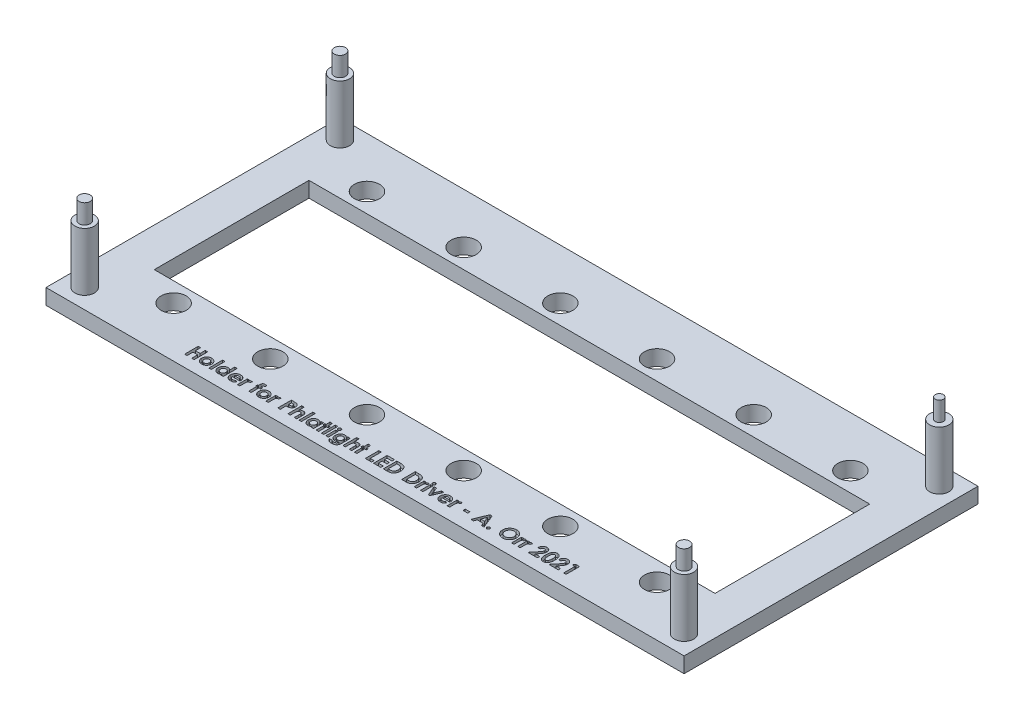
from build123d import *

# Parameters (mm, degrees)
SKETCH1_W           = 165
SKETCH1_H           = 76
BOSS_EXTRUDE1_DEPTH = 4
SKETCH2_R           = 2.5
BOSS_EXTRUDE2_DEPTH = 15
SKETCH3_R           = 1.05
SKETCH3_R_2         = 1.45
BOSS_EXTRUDE3_DEPTH = 5
SKETCH4_R           = 3.25
CUT_EXTRUDE1_DEPTH  = 97.717859219
SKETCH5_W           = 145
SKETCH5_H           = 40
CUT_EXTRUDE2_DEPTH  = 97.717859219
SKETCH6_W           = 0.628205128
SKETCH6_H           = 3.58974359
SKETCH6_W_2         = 0.628205129
SKETCH6_H_2         = 2.557692308
SKETCH6_W_3         = 1.211538461
SKETCH6_H_3         = 0.583333333
CUT_EXTRUDE3_DEPTH  = 1


with BuildPart() as part:
    # Sketch1 → Boss-Extrude1 (new body)
    with BuildSketch(Plane(origin=(0, 0, 0), x_dir=(1, 0, 0), z_dir=(0, 1, 0))):
        with Locations((1.371565063, 5.81671902)):
            Rectangle(SKETCH1_W, SKETCH1_H)
    extrude(amount=BOSS_EXTRUDE1_DEPTH)

    # Sketch2 → Boss-Extrude2 (add)
    with BuildSketch(Plane(origin=(0, 4, 0), x_dir=(1, 0, 0), z_dir=(0, 1, 0))):
        with Locations(Location((-76.128434937, -27.18328098, 0), (0, 0, 270))):
            Circle(SKETCH2_R)
        with Locations(Location((78.871565063, -27.18328098, 0), (0, 0, 90))):
            Circle(SKETCH2_R)
        with Locations(Location((78.871565063, 38.81671902, 0), (0, 0, 270))):
            Circle(SKETCH2_R)
        with Locations(Location((-76.128434937, 38.81671902, 0), (0, 0, 90))):
            Circle(SKETCH2_R)
    extrude(amount=BOSS_EXTRUDE2_DEPTH)

    # Sketch3 → Boss-Extrude3 (add)
    with BuildSketch(Plane(origin=(0, 19, 0), x_dir=(1, 0, 0), z_dir=(0, 1, 0))):
        with Locations(Location((78.871565063, 38.81671902, 0), (0, 0, 270))):
            Circle(SKETCH3_R)
        with Locations(Location((-76.128434937, -27.18328098, 0), (0, 0, 270))):
            Circle(SKETCH3_R_2)
        with Locations(Location((78.871565063, -27.18328098, 0), (0, 0, 270))):
            Circle(SKETCH3_R_2)
        with Locations(Location((-76.128434937, 38.81671902, 0), (0, 0, 270))):
            Circle(SKETCH3_R_2)
    extrude(amount=BOSS_EXTRUDE3_DEPTH)

    # Sketch4 → Cut-Extrude1 (cut, through all)
    with BuildSketch(Plane(origin=(0, 4, 0), x_dir=(1, 0, 0), z_dir=(0, 1, 0))):
        with Locations(Location((-61.128434937, 30.81671902, 0), (0, 0, 270))):
            Circle(SKETCH4_R)
        with Locations(Location((-36.128434937, 30.81671902, 0), (0, 0, 270))):
            Circle(SKETCH4_R)
        with Locations(Location((-11.128434937, 30.81671902, 0), (0, 0, 270))):
            Circle(SKETCH4_R)
        with Locations(Location((13.871565063, 30.81671902, 0), (0, 0, 270))):
            Circle(SKETCH4_R)
        with Locations(Location((38.871565063, 30.81671902, 0), (0, 0, 270))):
            Circle(SKETCH4_R)
        with Locations(Location((63.871565063, 30.81671902, 0), (0, 0, 270))):
            Circle(SKETCH4_R)
        with Locations(Location((63.871565063, -19.18328098, 0), (0, 0, 90))):
            Circle(SKETCH4_R)
        with Locations(Location((38.871565063, -19.18328098, 0), (0, 0, 90))):
            Circle(SKETCH4_R)
        with Locations(Location((13.871565063, -19.18328098, 0), (0, 0, 90))):
            Circle(SKETCH4_R)
        with Locations(Location((-11.128434937, -19.18328098, 0), (0, 0, 90))):
            Circle(SKETCH4_R)
        with Locations(Location((-36.128434937, -19.18328098, 0), (0, 0, 90))):
            Circle(SKETCH4_R)
        with Locations(Location((-61.128434937, -19.18328098, 0), (0, 0, 90))):
            Circle(SKETCH4_R)
    extrude(amount=-CUT_EXTRUDE1_DEPTH, mode=Mode.SUBTRACT)

    # Sketch5 → Cut-Extrude2 (cut, through all)
    with BuildSketch(Plane(origin=(0, 4, 0), x_dir=(1, 0, 0), z_dir=(0, 1, 0))):
        with Locations((1.371565063, 5.81671902)):
            Rectangle(SKETCH5_W, SKETCH5_H)
    extrude(amount=-CUT_EXTRUDE2_DEPTH, mode=Mode.SUBTRACT)

    # Sketch6 → Cut-Extrude3 (cut)
    # profile 1 of 40: a face of its own
    with BuildSketch(Plane(origin=(0, 4, 0), x_dir=(1, 0, 0), z_dir=(0, 1, 0))):
        Polygon((-48.279075962, -25.68328098), (-47.650870834, -25.68328098), (-47.650870834, -27.029434826), (-46.439332373, -27.029434826), (-46.439332373, -25.68328098), (-45.811127245, -25.68328098), (-45.811127245, -29.18328098), (-46.439332373, -29.18328098), (-46.439332373, -27.657639954), (-47.650870834, -27.657639954), (-47.650870834, -29.18328098), (-48.279075962, -29.18328098), align=None)
    # profile 2 of 40: a face of its own
    with BuildSketch(Plane(origin=(0, 4, 0), x_dir=(1, 0, 0), z_dir=(0, 1, 0))):
        with BuildLine():
            add(Edge.make_bspline(
                [(-43.874628847, -26.580716877), (-43.844928521, -26.581245415), (-43.786108419, -26.582292159), (-43.698503224, -26.591005346), (-43.612429569, -26.605221271), (-43.527392716, -26.623628413), (-43.444182311, -26.649419571), (-43.362361924, -26.680352078), (-43.281199978, -26.715866212), (-43.202710896, -26.758140455), (-43.126327654, -26.803990726), (-43.053911794, -26.854567337), (-42.986064681, -26.909473027), (-42.921526841, -26.967434762), (-42.863305842, -27.030976009), (-42.807681049, -27.097035083), (-42.757657735, -27.16797865), (-42.711343351, -27.24207798), (-42.670109989, -27.318904571), (-42.634306397, -27.39792399), (-42.603232246, -27.478043738), (-42.578901808, -27.560239727), (-42.558758448, -27.643428094), (-42.546046556, -27.728628251), (-42.537009282, -27.814964978), (-42.535995917, -27.873093968), (-42.535486219, -27.90233146)],
                knots=[0, 0, 0, 0, 1.022364134, 2.024744242, 3.027414945, 4.024939316, 5.017584196, 6.023349371, 7.035562955, 8.064994934, 9.090267829, 10.101425541, 11.102933353, 12.093946398, 13.084502048, 14.067315274, 15.065326281, 16.070028806, 17.074376865, 18.064572984, 19.055292013, 20.030201733, 21.013838017, 21.999348303, 22.993720005, 24, 24, 24, 24], degree=3))
            add(Edge.make_bspline(
                [(-42.535486219, -27.90233146), (-42.536024121, -27.931797371), (-42.537093592, -27.990382281), (-42.545719598, -28.077531112), (-42.559989937, -28.163131925), (-42.578467726, -28.247689011), (-42.604162367, -28.33012038), (-42.634183812, -28.411641103), (-42.671036316, -28.491140022), (-42.711779475, -28.569484396), (-42.758391641, -28.644368789), (-42.808371654, -28.71602304), (-42.863763463, -28.782567321), (-42.921518387, -28.846065356), (-42.984375873, -28.904369926), (-43.051332598, -28.958427742), (-43.121808903, -29.008899683), (-43.196311587, -29.054601584), (-43.273886394, -29.094758215), (-43.353225041, -29.130962695), (-43.434791455, -29.161105509), (-43.51841683, -29.185686144), (-43.604151883, -29.204718314), (-43.691807333, -29.217647094), (-43.781194401, -29.226638911), (-43.841419889, -29.227644905), (-43.87182436, -29.228152775)],
                knots=[0, 0, 0, 0, 1.012026251, 2.012137606, 3.004615893, 3.992048833, 4.982446996, 5.968083444, 6.973977695, 7.990229942, 8.999482246, 10.001782172, 10.988562221, 11.971415814, 12.948383116, 13.930088534, 14.925840678, 15.924049238, 16.929462851, 17.924729459, 18.917889337, 19.913673841, 20.916777188, 21.931792057, 22.95587778, 24, 24, 24, 24], degree=3))
            add(Edge.make_bspline(
                [(-43.87182436, -29.228152775), (-43.916281897, -29.226847858), (-44.003908379, -29.224275848), (-44.132961471, -29.206658252), (-44.256938891, -29.17633375), (-44.376042659, -29.134062064), (-44.490427493, -29.079892473), (-44.599095135, -29.012849377), (-44.703126531, -28.934252665), (-44.80071978, -28.844766641), (-44.890128416, -28.746592369), (-44.968237616, -28.641791933), (-45.034558649, -28.531936113), (-45.089031844, -28.416899639), (-45.131074043, -28.296524763), (-45.161435683, -28.171171364), (-45.179074819, -28.040487092), (-45.181625076, -27.951696428), (-45.182922116, -27.906538191)],
                knots=[0, 0, 0, 0, 1.029999031, 2.030143771, 3.011211297, 3.982305373, 4.953580601, 5.938004764, 6.935448627, 7.970290061, 9.001484052, 10.007591832, 10.993831261, 11.969999897, 12.951306496, 13.942897864, 14.953773953, 16, 16, 16, 16], degree=3))
            add(Edge.make_bspline(
                [(-45.182922116, -27.906538191), (-45.181579844, -27.858319094), (-45.178941634, -27.763545422), (-45.157993089, -27.624699835), (-45.124540523, -27.491761764), (-45.076521471, -27.365103082), (-45.015181356, -27.244490182), (-44.940298977, -27.130177451), (-44.851504261, -27.022138995), (-44.783505288, -26.956793633), (-44.748927725, -26.923565435)],
                knots=[0, 0, 0, 0, 1.043912699, 2.05178951, 3.033892, 4.007821512, 4.978932272, 5.95884105, 6.962068106, 8, 8, 8, 8], degree=3))
            add(Edge.make_bspline(
                [(-44.748927725, -26.923565435), (-44.717199355, -26.896022996), (-44.654605849, -26.841687465), (-44.552912001, -26.772771752), (-44.448788977, -26.713249601), (-44.340988817, -26.664311323), (-44.229211001, -26.62741265), (-44.114028328, -26.600553718), (-43.995464748, -26.584056175), (-43.915112172, -26.581835633), (-43.874628847, -26.580716877)],
                knots=[0, 0, 0, 0, 1.048115528, 2.067714963, 3.060638214, 4.039924844, 5.017819947, 5.994373833, 6.98952318, 8, 8, 8, 8], degree=3))
        make_face()
        with BuildLine():
            add(Edge.make_bspline(
                [(-43.860606411, -27.16405021), (-43.88492879, -27.164858606), (-43.932807654, -27.166449941), (-44.0032866, -27.17499021), (-44.069946329, -27.192494225), (-44.134110828, -27.214754542), (-44.194645021, -27.244524579), (-44.253206723, -27.279362383), (-44.306750855, -27.322957607), (-44.357868588, -27.37077838), (-44.404272096, -27.423882064), (-44.443812291, -27.481738488), (-44.479142331, -27.542134186), (-44.505931309, -27.607280321), (-44.528101749, -27.675396259), (-44.543106437, -27.747582547), (-44.553548652, -27.823032824), (-44.554323839, -27.874716782), (-44.554716988, -27.900929217)],
                knots=[0, 0, 0, 0, 1.030650113, 2.02884584, 2.99876339, 3.944280128, 4.900564847, 5.851248946, 6.823638398, 7.81794922, 8.81432732, 9.802856497, 10.78262424, 11.771747962, 12.779760563, 13.812642396, 14.89064281, 16, 16, 16, 16], degree=3))
            add(Edge.make_bspline(
                [(-44.554716988, -27.900929217), (-44.55425695, -27.928066034), (-44.553357893, -27.981099733), (-44.544047971, -28.058536065), (-44.528695603, -28.132022631), (-44.506884699, -28.201445909), (-44.479453804, -28.267304212), (-44.445799278, -28.329228031), (-44.405565933, -28.38684504), (-44.359951086, -28.440084289), (-44.310004776, -28.488410145), (-44.255277515, -28.529881586), (-44.198061073, -28.565914765), (-44.137036874, -28.594854968), (-44.073071636, -28.617199154), (-44.005975473, -28.633650426), (-43.935395794, -28.642513574), (-43.887271607, -28.64404025), (-43.862709777, -28.644819441)],
                knots=[0, 0, 0, 0, 1.141730614, 2.231293227, 3.276944405, 4.297399982, 5.28939179, 6.275415646, 7.257752684, 8.24146775, 9.222424823, 10.176631434, 11.126518621, 12.063689483, 13.012557477, 13.974037417, 14.965980454, 16, 16, 16, 16], degree=3))
            add(Edge.make_bspline(
                [(-43.862709777, -28.644819441), (-43.838135661, -28.644128333), (-43.78995613, -28.642773361), (-43.719293568, -28.632626758), (-43.651854763, -28.616658005), (-43.587343212, -28.594121512), (-43.526280497, -28.564561858), (-43.468432865, -28.528356293), (-43.413291423, -28.486308021), (-43.362674829, -28.437070348), (-43.315820016, -28.383665064), (-43.274731147, -28.325743899), (-43.240395739, -28.263820065), (-43.212234556, -28.198283187), (-43.190380896, -28.129223347), (-43.175282689, -28.056383856), (-43.164834891, -27.97999045), (-43.164077236, -27.927608431), (-43.163691347, -27.900929217)],
                knots=[0, 0, 0, 0, 1.031504075, 2.022346795, 2.991027682, 3.937587355, 4.885570121, 5.833146507, 6.798790848, 7.791235734, 8.792807298, 9.778388351, 10.766749885, 11.760164525, 12.768777521, 13.802286646, 14.880660483, 16, 16, 16, 16], degree=3))
            add(Edge.make_bspline(
                [(-43.163691347, -27.900929217), (-43.164157238, -27.874259328), (-43.165071467, -27.821924353), (-43.174382052, -27.745427626), (-43.189583756, -27.672823573), (-43.211675973, -27.604422207), (-43.238943822, -27.539443177), (-43.27262161, -27.478219085), (-43.313053373, -27.421051477), (-43.358889967, -27.368223821), (-43.409585003, -27.320576087), (-43.463362067, -27.278085875), (-43.521450876, -27.242943205), (-43.582761647, -27.2139731), (-43.647457501, -27.19168474), (-43.715465805, -27.175140234), (-43.786994984, -27.166403205), (-43.835812826, -27.164842739), (-43.860606411, -27.16405021)],
                knots=[0, 0, 0, 0, 1.123894411, 2.205445421, 3.243160173, 4.246488011, 5.231014757, 6.210004299, 7.185865357, 8.177612767, 9.153374344, 10.115157457, 11.061423229, 12.009021698, 12.96873347, 13.94135618, 14.954456845, 16, 16, 16, 16], degree=3))
        make_face(mode=Mode.SUBTRACT)
    # profile 3 of 40: a face of its own
    with BuildSketch(Plane(origin=(0, 4, 0), x_dir=(1, 0, 0), z_dir=(0, 1, 0))):
        with Locations((-41.727793911, -27.388409185)):
            Rectangle(SKETCH6_W, SKETCH6_H)
    # profile 4 of 40: a face of its own
    with BuildSketch(Plane(origin=(0, 4, 0), x_dir=(1, 0, 0), z_dir=(0, 1, 0))):
        with BuildLine():
            Line((-38.900870834, -25.59353739), (-38.272665706, -25.59353739))
            Line((-38.272665706, -25.59353739), (-38.272665706, -29.18328098))
            Line((-38.272665706, -29.18328098), (-38.900870834, -29.18328098))
            Line((-38.900870834, -29.18328098), (-38.900870834, -28.904234505))
            add(Edge.make_bspline(
                [(-38.900870834, -28.904234505), (-38.931998167, -28.931396591), (-38.992410173, -28.984112836), (-39.087599945, -29.052513504), (-39.183067873, -29.108935215), (-39.279272683, -29.15387203), (-39.377693002, -29.187053243), (-39.479037417, -29.211077217), (-39.584765395, -29.225244742), (-39.656637818, -29.227173333), (-39.693138462, -29.228152775)],
                knots=[0, 0, 0, 0, 1.129196829, 2.191548051, 3.199897424, 4.157751732, 5.089409408, 6.034969131, 7.002052659, 8, 8, 8, 8], degree=3))
            add(Edge.make_bspline(
                [(-39.693138462, -29.228152775), (-39.734112059, -29.227230997), (-39.815078207, -29.225409512), (-39.93388704, -29.206235442), (-40.048608781, -29.176885255), (-40.159150306, -29.135351072), (-40.265310496, -29.081530913), (-40.367901797, -29.016829022), (-40.465165483, -28.938973975), (-40.55791124, -28.851334361), (-40.642828699, -28.754930163), (-40.717064343, -28.651099456), (-40.779639474, -28.541314851), (-40.83090393, -28.425940334), (-40.871230045, -28.305060584), (-40.899976794, -28.178292206), (-40.91693741, -28.045589925), (-40.919036656, -27.955198328), (-40.920101604, -27.909342678)],
                knots=[0, 0, 0, 0, 0.980476535, 1.937477201, 2.874147792, 3.812856188, 4.758993464, 5.720109578, 6.712210464, 7.737600662, 8.772720504, 9.783789959, 10.789002326, 11.793715968, 12.802552247, 13.835794126, 14.902098527, 16, 16, 16, 16], degree=3))
            add(Edge.make_bspline(
                [(-40.920101604, -27.909342678), (-40.918983937, -27.861859092), (-40.91679151, -27.768714748), (-40.900754037, -27.632029851), (-40.872537773, -27.502118262), (-40.834062869, -27.378800033), (-40.784571586, -27.262053861), (-40.72429451, -27.151688477), (-40.652411627, -27.04799236), (-40.569579349, -26.95273049), (-40.480140832, -26.865418384), (-40.384457431, -26.789406272), (-40.284025424, -26.724830446), (-40.178738085, -26.672111513), (-40.068610449, -26.631372989), (-39.954077298, -26.601589801), (-39.834630187, -26.583718842), (-39.753261847, -26.581725842), (-39.712068751, -26.580716877)],
                knots=[0, 0, 0, 0, 1.136281865, 2.228943489, 3.287578264, 4.313574083, 5.316051562, 6.317280042, 7.318008486, 8.329309503, 9.333984563, 10.305318864, 11.248632312, 12.186624717, 13.117503092, 14.05354244, 15.014596925, 16, 16, 16, 16], degree=3))
            add(Edge.make_bspline(
                [(-39.712068751, -26.580716877), (-39.673935197, -26.581926734), (-39.598526092, -26.584319226), (-39.487133855, -26.599379365), (-39.379953367, -26.627736294), (-39.275682926, -26.664272113), (-39.175676681, -26.713436862), (-39.079397347, -26.772495496), (-38.986591241, -26.842198044), (-38.92980553, -26.896100088), (-38.900870834, -26.923565435)],
                knots=[0, 0, 0, 0, 1.011899165, 2.001030639, 2.974036179, 3.948778736, 4.92769327, 5.924124564, 6.942254589, 8, 8, 8, 8], degree=3))
            Line((-38.900870834, -26.923565435), (-38.900870834, -25.59353739))
        make_face()
        with BuildLine():
            add(Edge.make_bspline(
                [(-39.580257854, -27.16405021), (-39.605289976, -27.164818282), (-39.654351302, -27.166323653), (-39.726502695, -27.175378564), (-39.795457783, -27.191333719), (-39.860724783, -27.214904036), (-39.923276412, -27.243616116), (-39.982162816, -27.279577523), (-40.03787, -27.322083142), (-40.090070345, -27.370103913), (-40.137658651, -27.42288752), (-40.178682549, -27.480485871), (-40.213546234, -27.541347019), (-40.24303185, -27.605653951), (-40.264136862, -27.674167618), (-40.280852023, -27.745996093), (-40.289526109, -27.821726179), (-40.291098447, -27.873333889), (-40.291896475, -27.899526973)],
                knots=[0, 0, 0, 0, 1.04836806, 2.054732945, 3.03993516, 4.00574415, 4.955904794, 5.917688631, 6.888591924, 7.88601754, 8.884115178, 9.859153345, 10.841239365, 11.818093293, 12.814750328, 13.83810466, 14.90274714, 16, 16, 16, 16], degree=3))
            add(Edge.make_bspline(
                [(-40.291896475, -27.899526973), (-40.291110638, -27.925957644), (-40.289562153, -27.978038974), (-40.280711771, -28.054407871), (-40.264598091, -28.127285591), (-40.241088839, -28.19608297), (-40.21237859, -28.26172831), (-40.17743176, -28.323918653), (-40.1345057, -28.381554395), (-40.086875677, -28.435999392), (-40.03360445, -28.484616662), (-39.977582052, -28.527784333), (-39.918043262, -28.563902696), (-39.855634033, -28.593093786), (-39.790564437, -28.61688207), (-39.7220187, -28.632636702), (-39.650668314, -28.642708341), (-39.602026871, -28.644110882), (-39.577453366, -28.644819441)],
                knots=[0, 0, 0, 0, 1.099136573, 2.165835871, 3.191374663, 4.196217796, 5.183857741, 6.167377911, 7.154730987, 8.166690795, 9.170734848, 10.148332609, 11.103258353, 12.059567475, 13.009337315, 13.978056681, 14.978520572, 16, 16, 16, 16], degree=3))
            add(Edge.make_bspline(
                [(-39.577453366, -28.644819441), (-39.551954991, -28.644047063), (-39.501964315, -28.642532783), (-39.428635808, -28.633560508), (-39.358754406, -28.617546851), (-39.292610853, -28.593841589), (-39.22919487, -28.565335605), (-39.169078729, -28.530076912), (-39.11291478, -28.487668831), (-39.060418579, -28.439213951), (-39.012315931, -28.385999335), (-38.970724705, -28.327645672), (-38.934497227, -28.266019275), (-38.906005981, -28.199663069), (-38.883379937, -28.12973798), (-38.867146272, -28.055810036), (-38.858316099, -27.977799535), (-38.856781158, -27.924554328), (-38.855999039, -27.897423608)],
                knots=[0, 0, 0, 0, 1.050008698, 2.058587853, 3.036635738, 3.995319155, 4.947022481, 5.895997462, 6.858296291, 7.838991643, 8.833936038, 9.806048392, 10.784806122, 11.771666913, 12.772873988, 13.80724452, 14.882696879, 16, 16, 16, 16], degree=3))
            add(Edge.make_bspline(
                [(-38.855999039, -27.897423608), (-38.856771439, -27.870759523), (-38.858280161, -27.81867682), (-38.867184354, -27.742295141), (-38.883533269, -27.669818805), (-38.905693632, -27.601114589), (-38.934691745, -27.536339587), (-38.970946635, -27.476211997), (-39.012081628, -27.418648625), (-39.060716843, -27.366871629), (-39.11292866, -27.3187676), (-39.16991859, -27.277641971), (-39.229891143, -27.242198762), (-39.293214789, -27.213098521), (-39.360475877, -27.191766941), (-39.430476701, -27.17525068), (-39.50430942, -27.166329088), (-39.554528578, -27.164822232), (-39.580257854, -27.16405021)],
                knots=[0, 0, 0, 0, 1.106611376, 2.161533483, 3.185006901, 4.184773755, 5.152708835, 6.122342771, 7.094156588, 8.082475533, 9.064254463, 10.03606828, 10.992420271, 11.951521816, 12.920622147, 13.915721683, 14.932141191, 16, 16, 16, 16], degree=3))
        make_face(mode=Mode.SUBTRACT)
    # profile 5 of 40: a face of its own
    with BuildSketch(Plane(origin=(0, 4, 0), x_dir=(1, 0, 0), z_dir=(0, 1, 0))):
        with BuildLine():
            Line((-35.088871636, -28.061486108), (-37.105999039, -28.061486108))
            add(Edge.make_bspline(
                [(-37.105999039, -28.061486108), (-37.10188628, -28.084923984), (-37.093804382, -28.13098126), (-37.076254254, -28.197883449), (-37.053857658, -28.260930943), (-37.027016749, -28.320208021), (-36.996184063, -28.376028057), (-36.96022029, -28.428129234), (-36.919581596, -28.476465531), (-36.874502945, -28.520826876), (-36.825735715, -28.560575603), (-36.773516409, -28.595398), (-36.71779114, -28.623950235), (-36.659198779, -28.648016807), (-36.597301503, -28.667079969), (-36.532008218, -28.68022747), (-36.463492004, -28.687993747), (-36.416816667, -28.68911705), (-36.392958174, -28.689691236)],
                knots=[0, 0, 0, 0, 1.091296461, 2.144483647, 3.168565212, 4.157007626, 5.126487748, 6.090021542, 7.05641414, 8.019231907, 8.98705074, 9.938580405, 10.892824166, 11.854447369, 12.841318655, 13.858982407, 14.905600794, 16, 16, 16, 16], degree=3))
            add(Edge.make_bspline(
                [(-36.392958174, -28.689691236), (-36.364159354, -28.688930919), (-36.307445996, -28.687433632), (-36.224360504, -28.674154916), (-36.14400473, -28.654098), (-36.067139123, -28.624271681), (-35.992873317, -28.587143158), (-35.922429953, -28.540885586), (-35.854589713, -28.486850764), (-35.813199172, -28.445200744), (-35.792096796, -28.423966076)],
                knots=[0, 0, 0, 0, 1.021034703, 2.010718019, 2.977989445, 3.954245119, 4.929443971, 5.918328161, 6.938689359, 8, 8, 8, 8], degree=3))
            Line((-35.792096796, -28.423966076), (-35.26625545, -28.674266557))
            add(Edge.make_bspline(
                [(-35.26625545, -28.674266557), (-35.282811258, -28.697144142), (-35.315615982, -28.742475237), (-35.369168594, -28.806267794), (-35.425054154, -28.865788838), (-35.483314343, -28.92064689), (-35.544023048, -28.970685626), (-35.607011392, -29.016514607), (-35.673199925, -29.056903345), (-35.741265219, -29.093805822), (-35.812614309, -29.125442145), (-35.88704974, -29.152420484), (-35.964256238, -29.176808673), (-36.045208753, -29.195391136), (-36.129233194, -29.210100863), (-36.216530565, -29.220546718), (-36.30708936, -29.226998622), (-36.368641645, -29.227763487), (-36.399969392, -29.228152775)],
                knots=[0, 0, 0, 0, 1.028154879, 2.037251081, 3.030720504, 4.000128189, 4.949298328, 5.894184978, 6.834267904, 7.770992897, 8.712077017, 9.673380525, 10.653304757, 11.658697181, 12.695551717, 13.758623199, 14.859225354, 16, 16, 16, 16], degree=3))
            add(Edge.make_bspline(
                [(-36.399969392, -29.228152775), (-36.448166617, -29.227170178), (-36.542558104, -29.22524582), (-36.680622717, -29.207385019), (-36.811745806, -29.177769887), (-36.936297617, -29.137512663), (-37.053739753, -29.084360516), (-37.164130337, -29.019351031), (-37.26857233, -28.943730569), (-37.363874444, -28.85591206), (-37.450697481, -28.760326833), (-37.526957439, -28.657674827), (-37.590770686, -28.548673232), (-37.643175408, -28.434043443), (-37.683906178, -28.313492054), (-37.713270701, -28.186966457), (-37.731271505, -28.054527085), (-37.733215682, -27.964321089), (-37.734204168, -27.918457262)],
                knots=[0, 0, 0, 0, 1.103565453, 2.161269334, 3.182010356, 4.179077853, 5.15417608, 6.128274628, 7.109042802, 8.101804412, 9.090965879, 10.063106201, 11.02526161, 11.978650795, 12.945248442, 13.93468508, 14.949922959, 16, 16, 16, 16], degree=3))
            add(Edge.make_bspline(
                [(-37.734204168, -27.918457262), (-37.733205953, -27.871427976), (-37.73124201, -27.778899969), (-37.713425688, -27.643402511), (-37.683824995, -27.514119609), (-37.642975079, -27.390873227), (-37.591365343, -27.273277904), (-37.526740182, -27.162362457), (-37.450735325, -27.057740739), (-37.364225066, -26.959902181), (-37.268519222, -26.871592193), (-37.166822722, -26.792890346), (-37.0579929, -26.727310743), (-36.943260715, -26.674322465), (-36.823360036, -26.631270826), (-36.696904978, -26.602623556), (-36.564857672, -26.583388629), (-36.474593042, -26.581617213), (-36.428715386, -26.580716877)],
                knots=[0, 0, 0, 0, 1.079208495, 2.12329425, 3.130605359, 4.119693003, 5.099659317, 6.073216462, 7.060498243, 8.06384408, 9.066070512, 10.045757761, 11.010926815, 11.975797609, 12.942977511, 13.929384301, 14.947594487, 16, 16, 16, 16], degree=3))
            add(Edge.make_bspline(
                [(-36.428715386, -26.580716877), (-36.380287263, -26.581714718), (-36.285203636, -26.583673875), (-36.146177445, -26.60138965), (-36.014183715, -26.631185372), (-35.888660077, -26.671094499), (-35.771209521, -26.725589325), (-35.659251302, -26.78899903), (-35.555470812, -26.866254085), (-35.458761862, -26.953642839), (-35.37146227, -27.050597633), (-35.295152754, -27.155920234), (-35.230222748, -27.268582757), (-35.177596333, -27.38904207), (-35.136907386, -27.516936544), (-35.107515681, -27.652100082), (-35.08965218, -27.795046782), (-35.08774418, -27.89293058), (-35.08676827, -27.942996525)],
                knots=[0, 0, 0, 0, 1.080001299, 2.120471247, 3.119684163, 4.095710327, 5.052285597, 6.002875087, 6.961153713, 7.931888285, 8.906493152, 9.865905668, 10.82813294, 11.801621613, 12.7925306, 13.817193356, 14.883530496, 16, 16, 16, 16], degree=3))
            Line((-35.08676827, -27.942996525), (-35.088871636, -28.061486108))
        make_face()
        with BuildLine():
            add(Edge.make_bspline(
                [(-35.714973398, -27.567896364), (-35.726828013, -27.53590556), (-35.750398076, -27.472299509), (-35.803641867, -27.384538678), (-35.874294674, -27.308534234), (-35.956468957, -27.241246897), (-36.05035822, -27.186632291), (-36.15300385, -27.147089543), (-36.263108423, -27.123379215), (-36.338854437, -27.12059841), (-36.377533495, -27.119178416)],
                knots=[0, 0, 0, 0, 0.954238005, 1.897273737, 2.851915805, 3.847685534, 4.862635127, 5.880135777, 6.917509367, 8, 8, 8, 8], degree=3))
            add(Edge.make_bspline(
                [(-36.377533495, -27.119178416), (-36.419777323, -27.120542493), (-36.502355211, -27.123208981), (-36.621468193, -27.151568054), (-36.733824488, -27.193893123), (-36.800063392, -27.237531168), (-36.833262661, -27.259402775)],
                knots=[0, 0, 0, 0, 1.044195649, 2.041185066, 3.018232172, 4, 4, 4, 4], degree=3))
            add(Edge.make_bspline(
                [(-36.833262661, -27.259402775), (-36.853976526, -27.276060669), (-36.898137426, -27.311574448), (-36.955489314, -27.382421066), (-37.011981402, -27.468200417), (-37.044100268, -27.533355893), (-37.061127245, -27.567896364)],
                knots=[0, 0, 0, 0, 0.82159062, 1.751589201, 2.808063854, 4, 4, 4, 4], degree=3))
            Line((-37.061127245, -27.567896364), (-35.714973398, -27.567896364))
        make_face(mode=Mode.SUBTRACT)
    # profile 6 of 40: a face of its own
    with BuildSketch(Plane(origin=(0, 4, 0), x_dir=(1, 0, 0), z_dir=(0, 1, 0))):
        with BuildLine():
            Line((-34.638050321, -26.625588672), (-34.099588783, -26.625588672))
            Line((-34.099588783, -26.625588672), (-34.099588783, -26.940392358))
            add(Edge.make_bspline(
                [(-34.099588783, -26.940392358), (-34.08435674, -26.912415668), (-34.054585079, -26.857734066), (-33.999892042, -26.784334845), (-33.937058466, -26.722520068), (-33.868342156, -26.670996825), (-33.793534845, -26.630839515), (-33.714639741, -26.60222237), (-33.632331789, -26.583625191), (-33.576184095, -26.581693295), (-33.54780593, -26.580716877)],
                knots=[0, 0, 0, 0, 1.09866127, 2.147379032, 3.14564304, 4.131443017, 5.102343063, 6.064490016, 7.021754664, 8, 8, 8, 8], degree=3))
            add(Edge.make_bspline(
                [(-33.54780593, -26.580716877), (-33.527199842, -26.581681782), (-33.485238489, -26.583646674), (-33.421283481, -26.59506862), (-33.356405715, -26.615721671), (-33.313710554, -26.634316998), (-33.291896475, -26.643817839)],
                knots=[0, 0, 0, 0, 0.931404136, 1.896671404, 2.925354185, 4, 4, 4, 4], degree=3))
            Line((-33.291896475, -26.643817839), (-33.486808334, -27.175969281))
            add(Edge.make_bspline(
                [(-33.486808334, -27.175969281), (-33.504230671, -27.16755165), (-33.536977958, -27.151729745), (-33.584521332, -27.133058266), (-33.627668915, -27.121665842), (-33.65502369, -27.119965993), (-33.667697757, -27.119178416)],
                knots=[0, 0, 0, 0, 1.214386998, 2.282580073, 3.20428172, 4, 4, 4, 4], degree=3))
            add(Edge.make_bspline(
                [(-33.667697757, -27.119178416), (-33.679664541, -27.119700306), (-33.703205267, -27.120726954), (-33.73795072, -27.129524983), (-33.7706737, -27.14469691), (-33.802951129, -27.164133655), (-33.832236672, -27.191152184), (-33.861504127, -27.222430929), (-33.887296176, -27.261048699), (-33.914514267, -27.304032239), (-33.937689498, -27.356644053), (-33.957561545, -27.419451717), (-33.975267699, -27.493181958), (-33.98745195, -27.578226249), (-33.999228518, -27.673761639), (-34.00623822, -27.780489346), (-34.01146264, -27.898071886), (-34.011782078, -27.980148743), (-34.011948559, -28.022924409)],
                knots=[0, 0, 0, 0, 0.544232178, 1.070598461, 1.618251235, 2.182094276, 2.777567932, 3.425210017, 4.127676488, 4.886675562, 5.738955394, 6.734782583, 7.883056018, 9.186093582, 10.642914445, 12.264202625, 14.053029461, 16, 16, 16, 16], degree=3))
            Line((-34.011948559, -28.022924409), (-34.009845193, -28.147724089))
            Line((-34.009845193, -28.147724089), (-34.009845193, -29.18328098))
            Line((-34.009845193, -29.18328098), (-34.638050321, -29.18328098))
            Line((-34.638050321, -29.18328098), (-34.638050321, -26.625588672))
        make_face()
    # profile 7 of 40: a face of its own
    with BuildSketch(Plane(origin=(0, 4, 0), x_dir=(1, 0, 0), z_dir=(0, 1, 0))):
        with BuildLine():
            Line((-31.945742629, -26.625588672), (-31.721383655, -26.625588672))
            add(Edge.make_bspline(
                [(-31.721383655, -26.625588672), (-31.721233721, -26.5849228), (-31.720950217, -26.508029166), (-31.71927589, -26.399126388), (-31.718146809, -26.303297005), (-31.716130021, -26.220555756), (-31.713291607, -26.151145006), (-31.710381933, -26.095068548), (-31.708202392, -26.051972573), (-31.705129528, -26.027755678), (-31.70385561, -26.017716076)],
                knots=[0, 0, 0, 0, 1.604323161, 3.033556972, 4.296844687, 5.385167547, 6.298701784, 7.037230881, 7.60086462, 8, 8, 8, 8], degree=3))
            add(Edge.make_bspline(
                [(-31.70385561, -26.017716076), (-31.697882056, -25.983271465), (-31.686237579, -25.916127263), (-31.647690598, -25.822541842), (-31.591678727, -25.741018227), (-31.532302706, -25.683474549), (-31.477276356, -25.644190937), (-31.431113821, -25.618533404), (-31.380920476, -25.596537056), (-31.326534147, -25.579289283), (-31.268472085, -25.565200057), (-31.206107699, -25.555405926), (-31.139783141, -25.550008501), (-31.094122941, -25.549120365), (-31.070742629, -25.548665595)],
                knots=[0, 0, 0, 0, 1.43722947, 2.801646624, 4.13175475, 5.486897933, 6.18427957, 6.91287343, 7.658885333, 8.438447905, 9.260561323, 10.118602268, 11.036630026, 12, 12, 12, 12], degree=3))
            add(Edge.make_bspline(
                [(-31.070742629, -25.548665595), (-31.034920147, -25.54978349), (-30.960309122, -25.552111839), (-30.84567535, -25.570935113), (-30.724056916, -25.599750498), (-30.642178235, -25.626564936), (-30.599588783, -25.64051255)],
                knots=[0, 0, 0, 0, 0.891275659, 1.856347963, 2.884972697, 4, 4, 4, 4], degree=3))
            Line((-30.599588783, -25.64051255), (-30.599588783, -26.129194441))
            add(Edge.make_bspline(
                [(-30.599588783, -26.129194441), (-30.622432267, -26.122878603), (-30.665999897, -26.110832888), (-30.728686814, -26.097461074), (-30.785169627, -26.089204012), (-30.820653404, -26.087789496), (-30.837269071, -26.087127133)],
                knots=[0, 0, 0, 0, 1.174725213, 2.24046353, 3.176077791, 4, 4, 4, 4], degree=3))
            add(Edge.make_bspline(
                [(-30.837269071, -26.087127133), (-30.855555782, -26.087512492), (-30.889822259, -26.088234594), (-30.937320583, -26.097421143), (-30.977989276, -26.111885772), (-30.99908361, -26.128405426), (-31.009043911, -26.136205659)],
                knots=[0, 0, 0, 0, 1.199997209, 2.248609783, 3.173030359, 4, 4, 4, 4], degree=3))
            add(Edge.make_bspline(
                [(-31.009043911, -26.136205659), (-31.015071135, -26.143904928), (-31.028387242, -26.160915128), (-31.040490729, -26.195625546), (-31.046635535, -26.239496451), (-31.047715197, -26.271963193), (-31.048306732, -26.289751332)],
                knots=[0, 0, 0, 0, 0.721105823, 1.593158367, 2.681320256, 4, 4, 4, 4], degree=3))
            Line((-31.048306732, -26.289751332), (-31.050410097, -26.625588672))
            Line((-31.050410097, -26.625588672), (-30.644460578, -26.625588672))
            Line((-30.644460578, -26.625588672), (-30.644460578, -27.16405021))
            Line((-30.644460578, -27.16405021), (-31.093178527, -27.16405021))
            Line((-31.093178527, -27.16405021), (-31.093178527, -29.18328098))
            Line((-31.093178527, -29.18328098), (-31.721383655, -29.18328098))
            Line((-31.721383655, -29.18328098), (-31.721383655, -27.16405021))
            Line((-31.721383655, -27.16405021), (-31.945742629, -27.16405021))
            Line((-31.945742629, -27.16405021), (-31.945742629, -26.625588672))
        make_face()
    # profile 8 of 40: a face of its own
    with BuildSketch(Plane(origin=(0, 4, 0), x_dir=(1, 0, 0), z_dir=(0, 1, 0))):
        with BuildLine():
            add(Edge.make_bspline(
                [(-29.066936539, -26.580716877), (-29.037236214, -26.581245415), (-28.978416111, -26.582292159), (-28.890810916, -26.591005346), (-28.804737262, -26.605221271), (-28.719700409, -26.623628413), (-28.636490003, -26.649419571), (-28.554669616, -26.680352078), (-28.47350767, -26.715866212), (-28.395018589, -26.758140455), (-28.318635346, -26.803990726), (-28.246219487, -26.854567337), (-28.178372373, -26.909473027), (-28.113834533, -26.967434762), (-28.055613534, -27.030976009), (-27.999988741, -27.097035083), (-27.949965427, -27.16797865), (-27.903651044, -27.24207798), (-27.862417681, -27.318904571), (-27.826614089, -27.39792399), (-27.795539938, -27.478043738), (-27.7712095, -27.560239727), (-27.75106614, -27.643428094), (-27.738354248, -27.728628251), (-27.729316974, -27.814964978), (-27.728303609, -27.873093968), (-27.727793911, -27.90233146)],
                knots=[0, 0, 0, 0, 1.022364134, 2.024744242, 3.027414945, 4.024939316, 5.017584196, 6.023349371, 7.035562955, 8.064994934, 9.090267829, 10.101425541, 11.102933353, 12.093946398, 13.084502048, 14.067315274, 15.065326281, 16.070028806, 17.074376865, 18.064572984, 19.055292013, 20.030201733, 21.013838017, 21.999348303, 22.993720005, 24, 24, 24, 24], degree=3))
            add(Edge.make_bspline(
                [(-27.727793911, -27.90233146), (-27.728331813, -27.931797371), (-27.729401285, -27.990382281), (-27.738027291, -28.077531112), (-27.75229763, -28.163131925), (-27.770775419, -28.247689011), (-27.796470059, -28.33012038), (-27.826491504, -28.411641103), (-27.863344009, -28.491140022), (-27.904087168, -28.569484396), (-27.950699333, -28.644368789), (-28.000679347, -28.71602304), (-28.056071155, -28.782567321), (-28.113826079, -28.846065356), (-28.176683565, -28.904369926), (-28.24364029, -28.958427742), (-28.314116595, -29.008899683), (-28.388619279, -29.054601584), (-28.466194086, -29.094758215), (-28.545532733, -29.130962695), (-28.627099147, -29.161105509), (-28.710724523, -29.185686144), (-28.796459576, -29.204718314), (-28.884115025, -29.217647094), (-28.973502094, -29.226638911), (-29.033727581, -29.227644905), (-29.064132052, -29.228152775)],
                knots=[0, 0, 0, 0, 1.012026251, 2.012137606, 3.004615893, 3.992048833, 4.982446996, 5.968083444, 6.973977695, 7.990229942, 8.999482246, 10.001782172, 10.988562221, 11.971415814, 12.948383116, 13.930088534, 14.925840678, 15.924049238, 16.929462851, 17.924729459, 18.917889337, 19.913673841, 20.916777188, 21.931792057, 22.95587778, 24, 24, 24, 24], degree=3))
            add(Edge.make_bspline(
                [(-29.064132052, -29.228152775), (-29.108589589, -29.226847858), (-29.196216072, -29.224275848), (-29.325269163, -29.206658252), (-29.449246583, -29.17633375), (-29.568350351, -29.134062064), (-29.682735186, -29.079892473), (-29.791402828, -29.012849377), (-29.895434224, -28.934252665), (-29.993027472, -28.844766641), (-30.082436108, -28.746592369), (-30.160545309, -28.641791933), (-30.226866341, -28.531936113), (-30.281339536, -28.416899639), (-30.323381735, -28.296524763), (-30.353743376, -28.171171364), (-30.371382511, -28.040487092), (-30.373932768, -27.951696428), (-30.375229809, -27.906538191)],
                knots=[0, 0, 0, 0, 1.029999031, 2.030143771, 3.011211297, 3.982305373, 4.953580601, 5.938004764, 6.935448627, 7.970290061, 9.001484052, 10.007591832, 10.993831261, 11.969999897, 12.951306496, 13.942897864, 14.953773953, 16, 16, 16, 16], degree=3))
            add(Edge.make_bspline(
                [(-30.375229809, -27.906538191), (-30.373887536, -27.858319094), (-30.371249327, -27.763545422), (-30.350300782, -27.624699835), (-30.316848215, -27.491761764), (-30.268829164, -27.365103082), (-30.207489048, -27.244490182), (-30.132606669, -27.130177451), (-30.043811953, -27.022138995), (-29.975812981, -26.956793633), (-29.941235418, -26.923565435)],
                knots=[0, 0, 0, 0, 1.043912699, 2.05178951, 3.033892, 4.007821512, 4.978932272, 5.95884105, 6.962068106, 8, 8, 8, 8], degree=3))
            add(Edge.make_bspline(
                [(-29.941235418, -26.923565435), (-29.909507047, -26.896022996), (-29.846913541, -26.841687465), (-29.745219694, -26.772771752), (-29.64109667, -26.713249601), (-29.533296509, -26.664311323), (-29.421518694, -26.62741265), (-29.30633602, -26.600553718), (-29.18777244, -26.584056175), (-29.107419864, -26.581835633), (-29.066936539, -26.580716877)],
                knots=[0, 0, 0, 0, 1.048115528, 2.067714963, 3.060638214, 4.039924844, 5.017819947, 5.994373833, 6.98952318, 8, 8, 8, 8], degree=3))
        make_face()
        with BuildLine():
            add(Edge.make_bspline(
                [(-29.052914104, -27.16405021), (-29.077236482, -27.164858606), (-29.125115346, -27.166449941), (-29.195594292, -27.17499021), (-29.262254022, -27.192494225), (-29.326418521, -27.214754542), (-29.386952713, -27.244524579), (-29.445514415, -27.279362383), (-29.499058547, -27.322957607), (-29.55017628, -27.37077838), (-29.596579788, -27.423882064), (-29.636119983, -27.481738488), (-29.671450023, -27.542134186), (-29.698239001, -27.607280321), (-29.720409441, -27.675396259), (-29.735414129, -27.747582547), (-29.745856344, -27.823032824), (-29.746631531, -27.874716782), (-29.74702468, -27.900929217)],
                knots=[0, 0, 0, 0, 1.030650113, 2.02884584, 2.99876339, 3.944280128, 4.900564847, 5.851248946, 6.823638398, 7.81794922, 8.81432732, 9.802856497, 10.78262424, 11.771747962, 12.779760563, 13.812642396, 14.89064281, 16, 16, 16, 16], degree=3))
            add(Edge.make_bspline(
                [(-29.74702468, -27.900929217), (-29.746564642, -27.928066034), (-29.745665585, -27.981099733), (-29.736355663, -28.058536065), (-29.721003295, -28.132022631), (-29.699192391, -28.201445909), (-29.671761496, -28.267304212), (-29.63810697, -28.329228031), (-29.597873626, -28.38684504), (-29.552258778, -28.440084289), (-29.502312468, -28.488410145), (-29.447585207, -28.529881586), (-29.390368765, -28.565914765), (-29.329344567, -28.594854968), (-29.265379329, -28.617199154), (-29.198283165, -28.633650426), (-29.127703486, -28.642513574), (-29.0795793, -28.64404025), (-29.055017469, -28.644819441)],
                knots=[0, 0, 0, 0, 1.141730614, 2.231293227, 3.276944405, 4.297399982, 5.28939179, 6.275415646, 7.257752684, 8.24146775, 9.222424823, 10.176631434, 11.126518621, 12.063689483, 13.012557477, 13.974037417, 14.965980454, 16, 16, 16, 16], degree=3))
            add(Edge.make_bspline(
                [(-29.055017469, -28.644819441), (-29.030443354, -28.644128333), (-28.982263822, -28.642773361), (-28.911601261, -28.632626758), (-28.844162455, -28.616658005), (-28.779650904, -28.594121512), (-28.718588189, -28.564561858), (-28.660740557, -28.528356293), (-28.605599115, -28.486308021), (-28.554982521, -28.437070348), (-28.508127708, -28.383665064), (-28.46703884, -28.325743899), (-28.432703432, -28.263820065), (-28.404542249, -28.198283187), (-28.382688588, -28.129223347), (-28.367590381, -28.056383856), (-28.357142583, -27.97999045), (-28.356384928, -27.927608431), (-28.355999039, -27.900929217)],
                knots=[0, 0, 0, 0, 1.031504075, 2.022346795, 2.991027682, 3.937587355, 4.885570121, 5.833146507, 6.798790848, 7.791235734, 8.792807298, 9.778388351, 10.766749885, 11.760164525, 12.768777521, 13.802286646, 14.880660483, 16, 16, 16, 16], degree=3))
            add(Edge.make_bspline(
                [(-28.355999039, -27.900929217), (-28.35646493, -27.874259328), (-28.357379159, -27.821924353), (-28.366689744, -27.745427626), (-28.381891449, -27.672823573), (-28.403983665, -27.604422207), (-28.431251514, -27.539443177), (-28.464929303, -27.478219085), (-28.505361065, -27.421051477), (-28.551197659, -27.368223821), (-28.601892695, -27.320576087), (-28.655669759, -27.278085875), (-28.713758568, -27.242943205), (-28.77506934, -27.2139731), (-28.839765193, -27.19168474), (-28.907773497, -27.175140234), (-28.979302676, -27.166403205), (-29.028120518, -27.164842739), (-29.052914104, -27.16405021)],
                knots=[0, 0, 0, 0, 1.123894411, 2.205445421, 3.243160173, 4.246488011, 5.231014757, 6.210004299, 7.185865357, 8.177612767, 9.153374344, 10.115157457, 11.061423229, 12.009021698, 12.96873347, 13.94135618, 14.954456845, 16, 16, 16, 16], degree=3))
        make_face(mode=Mode.SUBTRACT)
    # profile 9 of 40: a face of its own
    with BuildSketch(Plane(origin=(0, 4, 0), x_dir=(1, 0, 0), z_dir=(0, 1, 0))):
        with BuildLine():
            Line((-27.279075962, -26.625588672), (-26.740614424, -26.625588672))
            Line((-26.740614424, -26.625588672), (-26.740614424, -26.940392358))
            add(Edge.make_bspline(
                [(-26.740614424, -26.940392358), (-26.725382381, -26.912415668), (-26.69561072, -26.857734066), (-26.640917683, -26.784334845), (-26.578084107, -26.722520068), (-26.509367797, -26.670996825), (-26.434560486, -26.630839515), (-26.355665382, -26.60222237), (-26.27335743, -26.583625191), (-26.217209736, -26.581693295), (-26.188831571, -26.580716877)],
                knots=[0, 0, 0, 0, 1.09866127, 2.147379032, 3.14564304, 4.131443017, 5.102343063, 6.064490016, 7.021754664, 8, 8, 8, 8], degree=3))
            add(Edge.make_bspline(
                [(-26.188831571, -26.580716877), (-26.168225483, -26.581681782), (-26.12626413, -26.583646674), (-26.062309122, -26.59506862), (-25.997431356, -26.615721671), (-25.954736195, -26.634316998), (-25.932922116, -26.643817839)],
                knots=[0, 0, 0, 0, 0.931404136, 1.896671404, 2.925354185, 4, 4, 4, 4], degree=3))
            Line((-25.932922116, -26.643817839), (-26.127833975, -27.175969281))
            add(Edge.make_bspline(
                [(-26.127833975, -27.175969281), (-26.145256312, -27.16755165), (-26.178003599, -27.151729745), (-26.225546973, -27.133058266), (-26.268694556, -27.121665842), (-26.296049331, -27.119965993), (-26.308723398, -27.119178416)],
                knots=[0, 0, 0, 0, 1.214386998, 2.282580073, 3.20428172, 4, 4, 4, 4], degree=3))
            add(Edge.make_bspline(
                [(-26.308723398, -27.119178416), (-26.320690182, -27.119700306), (-26.344230908, -27.120726954), (-26.378976361, -27.129524983), (-26.411699342, -27.14469691), (-26.44397677, -27.164133655), (-26.473262313, -27.191152184), (-26.502529768, -27.222430929), (-26.528321817, -27.261048699), (-26.555539908, -27.304032239), (-26.578715139, -27.356644053), (-26.598587186, -27.419451717), (-26.61629334, -27.493181958), (-26.628477591, -27.578226249), (-26.640254159, -27.673761639), (-26.647263861, -27.780489346), (-26.652488281, -27.898071886), (-26.652807719, -27.980148743), (-26.6529742, -28.022924409)],
                knots=[0, 0, 0, 0, 0.544232178, 1.070598461, 1.618251235, 2.182094276, 2.777567932, 3.425210017, 4.127676488, 4.886675562, 5.738955394, 6.734782583, 7.883056018, 9.186093582, 10.642914445, 12.264202625, 14.053029461, 16, 16, 16, 16], degree=3))
            Line((-26.6529742, -28.022924409), (-26.650870834, -28.147724089))
            Line((-26.650870834, -28.147724089), (-26.650870834, -29.18328098))
            Line((-26.650870834, -29.18328098), (-27.279075962, -29.18328098))
            Line((-27.279075962, -29.18328098), (-27.279075962, -26.625588672))
        make_face()
    # profile 10 of 40: a face of its own
    with BuildSketch(Plane(origin=(0, 4, 0), x_dir=(1, 0, 0), z_dir=(0, 1, 0))):
        with BuildLine():
            Line((-24.182922116, -25.68328098), (-23.481800321, -25.68328098))
            add(Edge.make_bspline(
                [(-23.481800321, -25.68328098), (-23.435989933, -25.683486037), (-23.347612091, -25.683881635), (-23.220163972, -25.688678787), (-23.102586842, -25.697275576), (-22.994907714, -25.707899848), (-22.897170863, -25.722794664), (-22.809253893, -25.739870404), (-22.73113856, -25.760673626), (-22.661943997, -25.785366761), (-22.599844112, -25.814479003), (-22.541077592, -25.845485618), (-22.486972566, -25.882490921), (-22.43479819, -25.921506635), (-22.387537364, -25.966259918), (-22.342241675, -26.013772373), (-22.300829517, -26.065928306), (-22.263109003, -26.122096383), (-22.228890685, -26.181238858), (-22.198995273, -26.24346146), (-22.174745789, -26.30886265), (-22.154403488, -26.377019356), (-22.138064353, -26.447928609), (-22.127188504, -26.522026506), (-22.119801081, -26.598795668), (-22.119149243, -26.651044808), (-22.118819552, -26.677471685)],
                knots=[0, 0, 0, 0, 1.698747864, 3.27724071, 4.728299578, 6.070144658, 7.288476769, 8.393259625, 9.389771311, 10.283485332, 11.113357557, 11.931608583, 12.74405601, 13.541433047, 14.344816069, 15.154114104, 15.974336324, 16.810834471, 17.661136416, 18.50621059, 19.367396281, 20.244825668, 21.142564693, 22.063065223, 23.020325768, 24, 24, 24, 24], degree=3))
            add(Edge.make_bspline(
                [(-22.118819552, -26.677471685), (-22.119296573, -26.706707109), (-22.120233978, -26.76415831), (-22.129423564, -26.848374723), (-22.145122281, -26.928667448), (-22.165639683, -27.005713607), (-22.19424974, -27.078245621), (-22.226935388, -27.147994127), (-22.267149102, -27.213003589), (-22.313099698, -27.274087198), (-22.363282992, -27.331741593), (-22.418890333, -27.384302111), (-22.47886182, -27.432127057), (-22.5428503, -27.475717639), (-22.611096005, -27.514985926), (-22.683549693, -27.550299622), (-22.760706118, -27.580529288), (-22.814435531, -27.596339158), (-22.841676123, -27.604354698)],
                knots=[0, 0, 0, 0, 1.102006807, 2.165578795, 3.188629044, 4.184801286, 5.166646146, 6.124351954, 7.085497154, 8.042432466, 9.003981491, 9.963833307, 10.922997304, 11.89326795, 12.880200226, 13.889073926, 14.929769137, 16, 16, 16, 16], degree=3))
            add(Edge.make_bspline(
                [(-22.841676123, -27.604354698), (-22.859618344, -27.608818751), (-22.898486972, -27.618489329), (-22.962803876, -27.628307392), (-23.036922355, -27.637334498), (-23.121082082, -27.645092203), (-23.215331577, -27.650365634), (-23.319579583, -27.654483949), (-23.433873343, -27.65747839), (-23.513348704, -27.657584646), (-23.554716988, -27.657639954)],
                knots=[0, 0, 0, 0, 0.618981996, 1.340914327, 2.176866532, 3.120127938, 4.170906482, 5.338178032, 6.614476169, 8, 8, 8, 8], degree=3))
            Line((-23.554716988, -27.657639954), (-23.554716988, -29.18328098))
            Line((-23.554716988, -29.18328098), (-24.182922116, -29.18328098))
            Line((-24.182922116, -29.18328098), (-24.182922116, -25.68328098))
        make_face()
        with BuildLine():
            Line((-23.554716988, -27.029434826), (-23.332461379, -27.029434826))
            add(Edge.make_bspline(
                [(-23.332461379, -27.029434826), (-23.292018462, -27.029178386), (-23.217602894, -27.028706534), (-23.115977507, -27.021883273), (-23.034309391, -27.011462775), (-22.969790062, -26.996517372), (-22.918845942, -26.973835743), (-22.874909827, -26.94759737), (-22.8372247, -26.914419668), (-22.804594926, -26.876508466), (-22.778508406, -26.832946594), (-22.760418762, -26.784443374), (-22.748668086, -26.73201791), (-22.747582802, -26.695533257), (-22.74702468, -26.676770563)],
                knots=[0, 0, 0, 0, 1.8619151, 3.425951444, 4.686033666, 5.651700536, 6.461346321, 7.243864085, 7.999046032, 8.762387399, 9.539336099, 10.322741239, 11.137448474, 12, 12, 12, 12], degree=3))
            add(Edge.make_bspline(
                [(-22.74702468, -26.676770563), (-22.74757706, -26.660377841), (-22.748648811, -26.62857202), (-22.756522179, -26.582668331), (-22.769070062, -26.539876623), (-22.787251464, -26.5006438), (-22.810755711, -26.465036523), (-22.839412144, -26.43306882), (-22.872853045, -26.404056076), (-22.898671376, -26.388699187), (-22.911788302, -26.380897166)],
                knots=[0, 0, 0, 0, 1.102301479, 2.1387299, 3.123554645, 4.094223062, 5.036071848, 5.982632524, 6.975082478, 8, 8, 8, 8], degree=3))
            add(Edge.make_bspline(
                [(-22.911788302, -26.380897166), (-22.922899096, -26.375278119), (-22.946422922, -26.363381445), (-22.98648628, -26.349550692), (-23.032718783, -26.337882928), (-23.085432552, -26.328198797), (-23.144417298, -26.320682905), (-23.209662496, -26.314935129), (-23.281264162, -26.312623724), (-23.331058836, -26.311875772), (-23.357000642, -26.311486108)],
                knots=[0, 0, 0, 0, 0.656809284, 1.390599849, 2.23162475, 3.173112763, 4.218524733, 5.370385145, 6.63003504, 8, 8, 8, 8], degree=3))
            Line((-23.357000642, -26.311486108), (-23.554716988, -26.311486108))
            Line((-23.554716988, -26.311486108), (-23.554716988, -27.029434826))
        make_face(mode=Mode.SUBTRACT)
    # profile 11 of 40: a face of its own
    with BuildSketch(Plane(origin=(0, 4, 0), x_dir=(1, 0, 0), z_dir=(0, 1, 0))):
        with BuildLine():
            Line((-21.580358014, -25.59353739), (-20.952152886, -25.59353739))
            Line((-20.952152886, -25.59353739), (-20.952152886, -26.902531781))
            add(Edge.make_bspline(
                [(-20.952152886, -26.902531781), (-20.920508862, -26.876796992), (-20.858829176, -26.826635428), (-20.762051727, -26.761286813), (-20.66547445, -26.705521964), (-20.568072519, -26.660328367), (-20.470268497, -26.624912792), (-20.371893494, -26.599796657), (-20.272852805, -26.583318256), (-20.206457407, -26.581584928), (-20.173206571, -26.580716877)],
                knots=[0, 0, 0, 0, 1.13710654, 2.216417683, 3.252896077, 4.244436563, 5.207303112, 6.149540546, 7.073289332, 8, 8, 8, 8], degree=3))
            add(Edge.make_bspline(
                [(-20.173206571, -26.580716877), (-20.141387753, -26.581561163), (-20.078924741, -26.583218568), (-19.987287716, -26.595190236), (-19.899517746, -26.615790389), (-19.815398614, -26.644108872), (-19.735509043, -26.682193059), (-19.658810158, -26.726803876), (-19.586213629, -26.780251808), (-19.542042776, -26.821452081), (-19.519761059, -26.842235307)],
                knots=[0, 0, 0, 0, 1.056403236, 2.073808271, 3.062028718, 4.046096703, 5.014652014, 5.995532726, 6.988858718, 8, 8, 8, 8], degree=3))
            add(Edge.make_bspline(
                [(-19.519761059, -26.842235307), (-19.501461887, -26.861655328), (-19.464598041, -26.900777136), (-19.418685104, -26.968222228), (-19.379039742, -27.041686671), (-19.346734424, -27.121860803), (-19.322708462, -27.208781944), (-19.304107495, -27.301734027), (-19.293820765, -27.40173198), (-19.292551241, -27.470651813), (-19.291896475, -27.506197646)],
                knots=[0, 0, 0, 0, 0.887296576, 1.787466942, 2.706642908, 3.663267187, 4.658426068, 5.705361056, 6.816525637, 8, 8, 8, 8], degree=3))
            Line((-19.291896475, -27.506197646), (-19.291896475, -29.18328098))
            Line((-19.291896475, -29.18328098), (-19.920101604, -29.18328098))
            Line((-19.920101604, -29.18328098), (-19.920101604, -28.071301813))
            add(Edge.make_bspline(
                [(-19.920101604, -28.071301813), (-19.920223665, -28.036010951), (-19.920457304, -27.968460601), (-19.922555382, -27.871456525), (-19.92598161, -27.78333203), (-19.930667132, -27.704060485), (-19.937209146, -27.633973179), (-19.943643676, -27.572567753), (-19.952672829, -27.520138545), (-19.966192842, -27.463169228), (-19.988195467, -27.402235946), (-20.020168863, -27.337283686), (-20.062876534, -27.283678108), (-20.112300103, -27.239466946), (-20.1694453, -27.205723315), (-20.232266385, -27.180800855), (-20.301837318, -27.166785079), (-20.350060758, -27.164985644), (-20.375129648, -27.16405021)],
                knots=[0, 0, 0, 0, 1.461461505, 2.797388094, 4.017818807, 5.113567707, 6.085313608, 6.932873269, 7.669572396, 8.286941306, 9.355291607, 10.346554054, 11.270113241, 12.175128673, 13.078071705, 14.003657132, 14.962203834, 16, 16, 16, 16], degree=3))
            add(Edge.make_bspline(
                [(-20.375129648, -27.16405021), (-20.407786986, -27.165326893), (-20.471750063, -27.167827421), (-20.563475946, -27.193567359), (-20.648081005, -27.2342526), (-20.724577822, -27.290640513), (-20.79123668, -27.361268619), (-20.847086515, -27.444051813), (-20.892768623, -27.538162084), (-20.912513253, -27.60678892), (-20.92270577, -27.642215275)],
                knots=[0, 0, 0, 0, 0.993549393, 1.945978497, 2.879753144, 3.843180486, 4.826017097, 5.826060929, 6.877775219, 8, 8, 8, 8], degree=3))
            add(Edge.make_bspline(
                [(-20.92270577, -27.642215275), (-20.925243729, -27.653165045), (-20.931031105, -27.678134106), (-20.935463187, -27.720735612), (-20.942040327, -27.772233533), (-20.944321831, -27.832936471), (-20.948595629, -27.9027508), (-20.950132655, -27.981789474), (-20.95168005, -28.0701268), (-20.951990207, -28.132064487), (-20.952152886, -28.164551012)],
                knots=[0, 0, 0, 0, 0.514379255, 1.17295301, 1.959069106, 2.891908278, 3.953016936, 5.163065833, 6.51201855, 8, 8, 8, 8], degree=3))
            Line((-20.952152886, -28.164551012), (-20.952152886, -29.18328098))
            Line((-20.952152886, -29.18328098), (-21.580358014, -29.18328098))
            Line((-21.580358014, -29.18328098), (-21.580358014, -25.59353739))
        make_face()
    # profile 12 of 40: a face of its own
    with BuildSketch(Plane(origin=(0, 4, 0), x_dir=(1, 0, 0), z_dir=(0, 1, 0))):
        with Locations((-18.394460578, -27.388409185)):
            Rectangle(SKETCH6_W, SKETCH6_H)
    # profile 13 of 40: a face of its own
    with BuildSketch(Plane(origin=(0, 4, 0), x_dir=(1, 0, 0), z_dir=(0, 1, 0))):
        with BuildLine():
            Line((-15.567537501, -26.625588672), (-14.939332373, -26.625588672))
            Line((-14.939332373, -26.625588672), (-14.939332373, -29.18328098))
            Line((-14.939332373, -29.18328098), (-15.567537501, -29.18328098))
            Line((-15.567537501, -29.18328098), (-15.567537501, -28.904234505))
            add(Edge.make_bspline(
                [(-15.567537501, -28.904234505), (-15.598664834, -28.931396591), (-15.659076839, -28.984112836), (-15.754266612, -29.052513504), (-15.84973454, -29.108935215), (-15.94593935, -29.15387203), (-16.044359669, -29.187053243), (-16.145704083, -29.211077217), (-16.251432062, -29.225244742), (-16.323304485, -29.227173333), (-16.359805129, -29.228152775)],
                knots=[0, 0, 0, 0, 1.129196829, 2.191548051, 3.199897424, 4.157751732, 5.089409408, 6.034969131, 7.002052659, 8, 8, 8, 8], degree=3))
            add(Edge.make_bspline(
                [(-16.359805129, -29.228152775), (-16.400778725, -29.227230997), (-16.481744873, -29.225409512), (-16.600553707, -29.206235442), (-16.715275448, -29.176885255), (-16.825816973, -29.135351072), (-16.931977162, -29.081530913), (-17.034568464, -29.016829022), (-17.13183215, -28.938973975), (-17.224577907, -28.851334361), (-17.309495365, -28.754930163), (-17.383731009, -28.651099456), (-17.44630614, -28.541314851), (-17.497570597, -28.425940334), (-17.537896712, -28.305060584), (-17.566643461, -28.178292206), (-17.583604076, -28.045589925), (-17.585703323, -27.955198328), (-17.58676827, -27.909342678)],
                knots=[0, 0, 0, 0, 0.980476535, 1.937477201, 2.874147792, 3.812856188, 4.758993464, 5.720109578, 6.712210464, 7.737600662, 8.772720504, 9.783789959, 10.789002326, 11.793715968, 12.802552247, 13.835794126, 14.902098527, 16, 16, 16, 16], degree=3))
            add(Edge.make_bspline(
                [(-17.58676827, -27.909342678), (-17.585650604, -27.861859092), (-17.583458177, -27.768714748), (-17.567420704, -27.632029851), (-17.53920444, -27.502118262), (-17.500729536, -27.378800033), (-17.451238252, -27.262053861), (-17.390961176, -27.151688477), (-17.319078294, -27.04799236), (-17.236246015, -26.95273049), (-17.146807499, -26.865418384), (-17.051124098, -26.789406272), (-16.950692091, -26.724830446), (-16.845404751, -26.672111513), (-16.735277115, -26.631372989), (-16.620743965, -26.601589801), (-16.501296854, -26.583718842), (-16.419928513, -26.581725842), (-16.378735418, -26.580716877)],
                knots=[0, 0, 0, 0, 1.136281865, 2.228943489, 3.287578264, 4.313574083, 5.316051562, 6.317280042, 7.318008486, 8.329309503, 9.333984563, 10.305318864, 11.248632312, 12.186624717, 13.117503092, 14.05354244, 15.014596925, 16, 16, 16, 16], degree=3))
            add(Edge.make_bspline(
                [(-16.378735418, -26.580716877), (-16.340577264, -26.581509621), (-16.265076031, -26.583078175), (-16.154100097, -26.600109668), (-16.046469447, -26.625868593), (-15.942771211, -26.662570424), (-15.842154823, -26.708913953), (-15.746350948, -26.766985848), (-15.653263789, -26.834345375), (-15.596465986, -26.886954592), (-15.567537501, -26.91374973)],
                knots=[0, 0, 0, 0, 1.017011718, 2.012299608, 2.98747302, 3.965332399, 4.941441765, 5.936729654, 6.94912688, 8, 8, 8, 8], degree=3))
            Line((-15.567537501, -26.91374973), (-15.567537501, -26.625588672))
        make_face()
        with BuildLine():
            add(Edge.make_bspline(
                [(-16.24692452, -27.16405021), (-16.271956643, -27.164818282), (-16.321017968, -27.166323653), (-16.393169362, -27.175378564), (-16.46212445, -27.191333719), (-16.527391449, -27.214904036), (-16.589943079, -27.243616116), (-16.648829482, -27.279577523), (-16.704536666, -27.322083142), (-16.756737012, -27.370103913), (-16.804325318, -27.42288752), (-16.845349215, -27.480485871), (-16.8802129, -27.541347019), (-16.909698517, -27.605653951), (-16.930803529, -27.674167618), (-16.947518689, -27.745996093), (-16.956192776, -27.821726179), (-16.957765114, -27.873333889), (-16.958563142, -27.899526973)],
                knots=[0, 0, 0, 0, 1.04836806, 2.054732945, 3.03993516, 4.00574415, 4.955904794, 5.917688631, 6.888591924, 7.88601754, 8.884115178, 9.859153345, 10.841239365, 11.818093293, 12.814750328, 13.83810466, 14.90274714, 16, 16, 16, 16], degree=3))
            add(Edge.make_bspline(
                [(-16.958563142, -27.899526973), (-16.957777304, -27.925957644), (-16.95622882, -27.978038974), (-16.947378438, -28.054407871), (-16.931264758, -28.127285591), (-16.907755506, -28.19608297), (-16.879045257, -28.26172831), (-16.844098426, -28.323918653), (-16.801172367, -28.381554395), (-16.753542344, -28.435999392), (-16.700271117, -28.484616662), (-16.644248719, -28.527784333), (-16.584709928, -28.563902696), (-16.522300699, -28.593093786), (-16.457231104, -28.61688207), (-16.388685367, -28.632636702), (-16.31733498, -28.642708341), (-16.268693537, -28.644110882), (-16.244120033, -28.644819441)],
                knots=[0, 0, 0, 0, 1.099136573, 2.165835871, 3.191374663, 4.196217796, 5.183857741, 6.167377911, 7.154730987, 8.166690795, 9.170734848, 10.148332609, 11.103258353, 12.059567475, 13.009337315, 13.978056681, 14.978520572, 16, 16, 16, 16], degree=3))
            add(Edge.make_bspline(
                [(-16.244120033, -28.644819441), (-16.218621658, -28.644047063), (-16.168630981, -28.642532783), (-16.095302474, -28.633560508), (-16.025421073, -28.617546851), (-15.95927752, -28.593841589), (-15.895861537, -28.565335605), (-15.835745396, -28.530076912), (-15.779581447, -28.487668831), (-15.727085246, -28.439213951), (-15.678982597, -28.385999335), (-15.637391372, -28.327645672), (-15.601163893, -28.266019275), (-15.572672648, -28.199663069), (-15.550046603, -28.12973798), (-15.533812939, -28.055810036), (-15.524982766, -27.977799535), (-15.523447825, -27.924554328), (-15.522665706, -27.897423608)],
                knots=[0, 0, 0, 0, 1.050008698, 2.058587853, 3.036635738, 3.995319155, 4.947022481, 5.895997462, 6.858296291, 7.838991643, 8.833936038, 9.806048392, 10.784806122, 11.771666913, 12.772873988, 13.80724452, 14.882696879, 16, 16, 16, 16], degree=3))
            add(Edge.make_bspline(
                [(-15.522665706, -27.897423608), (-15.523438106, -27.870759523), (-15.524946828, -27.81867682), (-15.533851021, -27.742295141), (-15.550199935, -27.669818805), (-15.572360298, -27.601114589), (-15.601358412, -27.536339587), (-15.637613302, -27.476211997), (-15.678748295, -27.418648625), (-15.727383509, -27.366871629), (-15.779595326, -27.3187676), (-15.836585257, -27.277641971), (-15.896557809, -27.242198762), (-15.959881455, -27.213098521), (-16.027142543, -27.191766941), (-16.097143368, -27.17525068), (-16.170976087, -27.166329088), (-16.221195245, -27.164822232), (-16.24692452, -27.16405021)],
                knots=[0, 0, 0, 0, 1.106611376, 2.161533483, 3.185006901, 4.184773755, 5.152708835, 6.122342771, 7.094156588, 8.082475533, 9.064254463, 10.03606828, 10.992420271, 11.951521816, 12.920622147, 13.915721683, 14.932141191, 16, 16, 16, 16], degree=3))
        make_face(mode=Mode.SUBTRACT)
    # profile 14 of 40: a face of its own
    with BuildSketch(Plane(origin=(0, 4, 0), x_dir=(1, 0, 0), z_dir=(0, 1, 0))):
        Polygon((-14.26625545, -25.59353739), (-13.638050321, -25.59353739), (-13.638050321, -26.625588672), (-13.234204168, -26.625588672), (-13.234204168, -27.16405021), (-13.638050321, -27.16405021), (-13.638050321, -29.18328098), (-14.26625545, -29.18328098), (-14.26625545, -27.16405021), (-14.580358014, -27.16405021), (-14.580358014, -26.625588672), (-14.26625545, -26.625588672), align=None)
    # profile 15 of 40: a face of its own
    with BuildSketch(Plane(origin=(0, 4, 0), x_dir=(1, 0, 0), z_dir=(0, 1, 0))):
        with Locations((-12.60599904, -27.388409185)):
            Rectangle(SKETCH6_W_2, SKETCH6_H)
    # profile 16 of 40: a face of its own
    with BuildSketch(Plane(origin=(0, 4, 0), x_dir=(1, 0, 0), z_dir=(0, 1, 0))):
        with BuildLine():
            add(Edge.make_bspline(
                [(-11.440734616, -25.548665595), (-11.41365898, -25.549994028), (-11.360493359, -25.552602535), (-11.284326372, -25.578029672), (-11.214420514, -25.617936803), (-11.152621797, -25.672690338), (-11.101223403, -25.738076074), (-11.061953121, -25.811279752), (-11.040077283, -25.89238707), (-11.037039053, -25.948415157), (-11.035486219, -25.977051012)],
                knots=[0, 0, 0, 0, 0.989868614, 1.943702388, 2.910836514, 3.924849579, 4.949916355, 5.946401046, 6.950409252, 8, 8, 8, 8], degree=3))
            add(Edge.make_bspline(
                [(-11.035486219, -25.977051012), (-11.036983495, -26.005475836), (-11.039901009, -26.06086296), (-11.062456607, -26.140869208), (-11.100150716, -26.214037332), (-11.151965405, -26.278451968), (-11.213094143, -26.332323665), (-11.281472504, -26.372955286), (-11.356909591, -26.396967917), (-11.409250242, -26.39979448), (-11.435826764, -26.401229698)],
                knots=[0, 0, 0, 0, 1.05296456, 2.051751585, 3.055639087, 4.085634717, 5.099016424, 6.062201612, 7.016062274, 8, 8, 8, 8], degree=3))
            add(Edge.make_bspline(
                [(-11.435826764, -26.401229698), (-11.463138748, -26.399906013), (-11.516766908, -26.397306907), (-11.593558621, -26.371820277), (-11.664396844, -26.33222744), (-11.725927479, -26.276355205), (-11.777914499, -26.210504854), (-11.81546944, -26.135596931), (-11.838960984, -26.053935003), (-11.841749409, -25.997077102), (-11.843178527, -25.967936428)],
                knots=[0, 0, 0, 0, 0.989065327, 1.942068821, 2.907541208, 3.917690034, 4.939857478, 5.938239964, 6.943311734, 8, 8, 8, 8], degree=3))
            add(Edge.make_bspline(
                [(-11.843178527, -25.967936428), (-11.841623256, -25.939994274), (-11.838568153, -25.885105947), (-11.816561276, -25.805801882), (-11.77819146, -25.733828872), (-11.727163294, -25.669640084), (-11.665907378, -25.615907908), (-11.596043486, -25.577212782), (-11.520389105, -25.552835859), (-11.467560269, -25.550070036), (-11.440734616, -25.548665595)],
                knots=[0, 0, 0, 0, 1.038616768, 2.040212704, 3.031499824, 4.052181184, 5.074969369, 6.039807101, 7.004644834, 8, 8, 8, 8], degree=3))
        make_face()
    # profile 17 of 40: a face of its own
    with BuildSketch(Plane(origin=(0, 4, 0), x_dir=(1, 0, 0), z_dir=(0, 1, 0))):
        with Locations((-11.439332373, -27.904434826)):
            Rectangle(SKETCH6_W, SKETCH6_H_2)
    # profile 18 of 40: a face of its own
    with BuildSketch(Plane(origin=(0, 4, 0), x_dir=(1, 0, 0), z_dir=(0, 1, 0))):
        with BuildLine():
            Line((-8.657281091, -26.625588672), (-7.984204168, -26.625588672))
            Line((-7.984204168, -26.625588672), (-7.984204168, -28.807479698))
            add(Edge.make_bspline(
                [(-7.984204168, -28.807479698), (-7.985013031, -28.859619944), (-7.986574977, -28.960304808), (-7.998489951, -29.106223182), (-8.018359705, -29.241497541), (-8.046951579, -29.366319465), (-8.08387936, -29.480230173), (-8.129043438, -29.583608364), (-8.181525531, -29.677008426), (-8.224677494, -29.731584324), (-8.245722597, -29.758200851)],
                knots=[0, 0, 0, 0, 1.243822755, 2.401870584, 3.490053692, 4.503076575, 5.453444971, 6.342269266, 7.191528908, 8, 8, 8, 8], degree=3))
            add(Edge.make_bspline(
                [(-8.245722597, -29.758200851), (-8.275943656, -29.791349907), (-8.336232771, -29.857480191), (-8.442525861, -29.94093427), (-8.558973857, -30.012260972), (-8.686765129, -30.070716623), (-8.825747465, -30.115241181), (-8.975563833, -30.147306798), (-9.136309212, -30.167278775), (-9.247331744, -30.169380049), (-9.304416507, -30.170460467)],
                knots=[0, 0, 0, 0, 0.916003385, 1.827369254, 2.751972866, 3.703651841, 4.69362366, 5.730423306, 6.83304546, 8, 8, 8, 8], degree=3))
            add(Edge.make_bspline(
                [(-9.304416507, -30.170460467), (-9.364758405, -30.169526301), (-9.480811411, -30.167729661), (-9.647577188, -30.150154399), (-9.799484742, -30.121235518), (-9.937247427, -30.080521832), (-10.062148707, -30.027989402), (-10.176543904, -29.964999988), (-10.280213326, -29.889690958), (-10.374723983, -29.805031265), (-10.457883996, -29.709161737), (-10.528894489, -29.602960126), (-10.589391737, -29.487403274), (-10.619262941, -29.404766908), (-10.634444552, -29.362768159)],
                knots=[0, 0, 0, 0, 1.29412125, 2.488928388, 3.592140377, 4.607309753, 5.564519828, 6.493640275, 7.402258018, 8.307438948, 9.210158992, 10.116782752, 11.042881838, 12, 12, 12, 12], degree=3))
            Line((-10.634444552, -29.362768159), (-9.936127245, -29.362768159))
            add(Edge.make_bspline(
                [(-9.936127245, -29.362768159), (-9.919989878, -29.380533861), (-9.88751007, -29.416291034), (-9.830062142, -29.461664463), (-9.766511712, -29.500501906), (-9.696346058, -29.532303514), (-9.619272621, -29.556485784), (-9.535816052, -29.574857816), (-9.44560253, -29.585211418), (-9.38343537, -29.586475546), (-9.351391668, -29.587127133)],
                knots=[0, 0, 0, 0, 0.888971165, 1.789239437, 2.70354581, 3.646217955, 4.638595249, 5.694475788, 6.811630907, 8, 8, 8, 8], degree=3))
            add(Edge.make_bspline(
                [(-9.351391668, -29.587127133), (-9.310896854, -29.586370511), (-9.233555308, -29.584925428), (-9.124134083, -29.569125019), (-9.026418783, -29.545520133), (-8.941819977, -29.509995354), (-8.868832467, -29.467325207), (-8.80794311, -29.417758284), (-8.75766621, -29.363162027), (-8.724779857, -29.31180029), (-8.705237562, -29.265206866), (-8.691930425, -29.224974115), (-8.681824842, -29.178598568), (-8.672626095, -29.126948206), (-8.665749882, -29.069357601), (-8.661194303, -29.005948758), (-8.657243933, -28.937001045), (-8.657268431, -28.889050028), (-8.657281091, -28.864270563)],
                knots=[0, 0, 0, 0, 1.656375485, 3.163532, 4.516250129, 5.759907703, 6.905105653, 7.965920022, 8.961443813, 9.932912751, 10.442911961, 11.026787936, 11.664959534, 12.383728702, 13.174001396, 14.037595414, 14.985895623, 16, 16, 16, 16], degree=3))
            add(Edge.make_bspline(
                [(-8.657281091, -28.864270563), (-8.684802566, -28.891263234), (-8.73850779, -28.943936553), (-8.825689829, -29.011136366), (-8.914936085, -29.066641758), (-9.006759441, -29.110766115), (-9.102986055, -29.143086427), (-9.204181101, -29.166299056), (-9.311497064, -29.18044288), (-9.385235973, -29.182321349), (-9.422906091, -29.18328098)],
                knots=[0, 0, 0, 0, 1.082007397, 2.111422008, 3.08419067, 4.02964304, 4.965866572, 5.929243163, 6.942137121, 8, 8, 8, 8], degree=3))
            add(Edge.make_bspline(
                [(-9.422906091, -29.18328098), (-9.464573625, -29.182318381), (-9.546423439, -29.180427495), (-9.666643972, -29.162051781), (-9.781984882, -29.133460963), (-9.892756749, -29.093659871), (-9.997829267, -29.040818099), (-10.098697658, -28.977951129), (-10.193492535, -28.901757868), (-10.283521706, -28.816491672), (-10.364892143, -28.721714563), (-10.436493094, -28.619924076), (-10.496854492, -28.51182236), (-10.545942168, -28.397509907), (-10.585052496, -28.277466596), (-10.611968728, -28.151042541), (-10.628416638, -28.018451203), (-10.630551304, -27.928087734), (-10.631640065, -27.881998928)],
                knots=[0, 0, 0, 0, 1.007560175, 1.979205489, 2.935124557, 3.879618859, 4.820364716, 5.775815361, 6.749909327, 7.75781854, 8.772289371, 9.766897274, 10.764314289, 11.762244114, 12.772609037, 13.814079916, 14.885097635, 16, 16, 16, 16], degree=3))
            add(Edge.make_bspline(
                [(-10.631640065, -27.881998928), (-10.63068914, -27.832862019), (-10.628830676, -27.736830053), (-10.610612425, -27.596563103), (-10.582263946, -27.463348233), (-10.541795746, -27.337464101), (-10.488629613, -27.219448855), (-10.424380469, -27.10892802), (-10.349654391, -27.00463775), (-10.290502459, -26.942768905), (-10.260746636, -26.911646364)],
                knots=[0, 0, 0, 0, 1.104124469, 2.157873671, 3.173961494, 4.162551312, 5.124378318, 6.07778831, 7.033049473, 8, 8, 8, 8], degree=3))
            add(Edge.make_bspline(
                [(-10.260746636, -26.911646364), (-10.232508788, -26.885108902), (-10.176864699, -26.832815506), (-10.085775499, -26.7657144), (-9.99143702, -26.708161698), (-9.892555306, -26.661867038), (-9.789830044, -26.625000505), (-9.682653091, -26.599209439), (-9.57155736, -26.583307263), (-9.496109846, -26.581586784), (-9.45796218, -26.580716877)],
                knots=[0, 0, 0, 0, 1.042068658, 2.053448347, 3.038272799, 4.011764631, 4.986555969, 5.970496305, 6.973845226, 8, 8, 8, 8], degree=3))
            add(Edge.make_bspline(
                [(-9.45796218, -26.580716877), (-9.422164914, -26.581722052), (-9.351230363, -26.583713869), (-9.246136177, -26.597766984), (-9.144370768, -26.62259385), (-9.044819873, -26.656725572), (-8.946428337, -26.700939331), (-8.849281183, -26.758889979), (-8.751408783, -26.828182576), (-8.689305326, -26.882325045), (-8.657281091, -26.910244121)],
                knots=[0, 0, 0, 0, 0.968122651, 1.918396369, 2.861262201, 3.796768263, 4.761417965, 5.77287463, 6.85156174, 8, 8, 8, 8], degree=3))
            Line((-8.657281091, -26.910244121), (-8.657281091, -26.625588672))
        make_face()
        with BuildLine():
            add(Edge.make_bspline(
                [(-9.307922116, -27.16405021), (-9.332481983, -27.164841613), (-9.380834031, -27.16639968), (-9.451896278, -27.175177982), (-9.519334677, -27.191747871), (-9.583971147, -27.213263292), (-9.645019819, -27.242205795), (-9.702598709, -27.277517967), (-9.75739031, -27.318505654), (-9.807651124, -27.365942307), (-9.854239452, -27.417198695), (-9.893356638, -27.473609274), (-9.928217024, -27.531961931), (-9.955326145, -27.594604749), (-9.977743011, -27.659837735), (-9.991443274, -27.728988347), (-10.002390207, -27.800792644), (-10.003082171, -27.849934817), (-10.003434937, -27.87498771)],
                knots=[0, 0, 0, 0, 1.059154978, 2.085203149, 3.079850876, 4.048488546, 5.017545358, 5.985239295, 6.956545898, 7.961752598, 8.960830395, 9.936516972, 10.916356752, 11.886198968, 12.873933111, 13.883774911, 14.921139228, 16, 16, 16, 16], degree=3))
            add(Edge.make_bspline(
                [(-10.003434937, -27.87498771), (-10.003053082, -27.900967911), (-10.002303644, -27.951957255), (-9.991810827, -28.026239206), (-9.976821993, -28.097331503), (-9.954180125, -28.164366335), (-9.925834596, -28.228224505), (-9.891785037, -28.288874631), (-9.849752758, -28.344866597), (-9.803077348, -28.397432623), (-9.751441732, -28.444958324), (-9.69586056, -28.486295472), (-9.637478145, -28.521994353), (-9.575032451, -28.549828145), (-9.509874609, -28.572383169), (-9.441351098, -28.588762623), (-9.369619389, -28.59761235), (-9.320798287, -28.599161079), (-9.296003046, -28.599947646)],
                knots=[0, 0, 0, 0, 1.097915424, 2.154794285, 3.166904039, 4.167166757, 5.140698173, 6.119085138, 7.101657521, 8.095747232, 9.089148684, 10.06378348, 11.021581144, 11.977080764, 12.949256321, 13.934658686, 14.951055324, 16, 16, 16, 16], degree=3))
            add(Edge.make_bspline(
                [(-9.296003046, -28.599947646), (-9.271657099, -28.599565921), (-9.223922394, -28.598817479), (-9.154290956, -28.588318301), (-9.087763846, -28.573137376), (-9.02446088, -28.551428618), (-8.964733373, -28.523093977), (-8.907779851, -28.489280879), (-8.854808412, -28.448363183), (-8.804814441, -28.402102913), (-8.759698074, -28.350662718), (-8.719875425, -28.294927941), (-8.687162561, -28.234888517), (-8.659297893, -28.171495001), (-8.638666835, -28.103853151), (-8.623002084, -28.032634662), (-8.613813233, -27.957494521), (-8.612883316, -27.906095767), (-8.612409296, -27.879895563)],
                knots=[0, 0, 0, 0, 1.047368431, 2.053558439, 3.025081491, 3.983010266, 4.928381778, 5.867249904, 6.829345556, 7.804873619, 8.796055618, 9.770545002, 10.747991713, 11.735078325, 12.747239243, 13.787476531, 14.872179528, 16, 16, 16, 16], degree=3))
            add(Edge.make_bspline(
                [(-8.612409296, -27.879895563), (-8.612869182, -27.853926786), (-8.613767133, -27.803221445), (-8.623085744, -27.729036036), (-8.638614358, -27.658710881), (-8.65953119, -27.591665581), (-8.686790503, -27.528300516), (-8.720973562, -27.469205442), (-8.760063343, -27.413289143), (-8.806090203, -27.362456276), (-8.855700337, -27.315440636), (-8.910394272, -27.275666408), (-8.967436741, -27.240523335), (-9.028753714, -27.212663151), (-9.093583571, -27.190719753), (-9.162030435, -27.17570922), (-9.233745228, -27.16517611), (-9.282875361, -27.164430385), (-9.307922116, -27.16405021)],
                knots=[0, 0, 0, 0, 1.111098411, 2.169475416, 3.193737863, 4.190319778, 5.171520483, 6.139320596, 7.107999188, 8.085777416, 9.069626166, 10.027970922, 10.974971434, 11.932846196, 12.904000912, 13.89897495, 14.928888274, 16, 16, 16, 16], degree=3))
        make_face(mode=Mode.SUBTRACT)
    # profile 19 of 40: a face of its own
    with BuildSketch(Plane(origin=(0, 4, 0), x_dir=(1, 0, 0), z_dir=(0, 1, 0))):
        with BuildLine():
            Line((-7.355999039, -25.59353739), (-6.727793911, -25.59353739))
            Line((-6.727793911, -25.59353739), (-6.727793911, -26.902531781))
            add(Edge.make_bspline(
                [(-6.727793911, -26.902531781), (-6.696149887, -26.876796992), (-6.634470202, -26.826635428), (-6.537692753, -26.761286813), (-6.441115476, -26.705521964), (-6.343713544, -26.660328367), (-6.245909523, -26.624912792), (-6.147534519, -26.599796657), (-6.048493831, -26.583318256), (-5.982098433, -26.581584928), (-5.948847597, -26.580716877)],
                knots=[0, 0, 0, 0, 1.13710654, 2.216417683, 3.252896077, 4.244436563, 5.207303112, 6.149540546, 7.073289332, 8, 8, 8, 8], degree=3))
            add(Edge.make_bspline(
                [(-5.948847597, -26.580716877), (-5.917028779, -26.581561163), (-5.854565767, -26.583218568), (-5.762928742, -26.595190236), (-5.675158771, -26.615790389), (-5.591039639, -26.644108872), (-5.511150068, -26.682193059), (-5.434451184, -26.726803876), (-5.361854654, -26.780251808), (-5.317683801, -26.821452081), (-5.295402084, -26.842235307)],
                knots=[0, 0, 0, 0, 1.056403236, 2.073808271, 3.062028718, 4.046096703, 5.014652014, 5.995532726, 6.988858718, 8, 8, 8, 8], degree=3))
            add(Edge.make_bspline(
                [(-5.295402084, -26.842235307), (-5.277102913, -26.861655328), (-5.240239066, -26.900777136), (-5.19432613, -26.968222228), (-5.154680768, -27.041686671), (-5.122375449, -27.121860803), (-5.098349488, -27.208781944), (-5.079748521, -27.301734027), (-5.069461791, -27.40173198), (-5.068192266, -27.470651813), (-5.067537501, -27.506197646)],
                knots=[0, 0, 0, 0, 0.887296576, 1.787466942, 2.706642908, 3.663267187, 4.658426068, 5.705361056, 6.816525637, 8, 8, 8, 8], degree=3))
            Line((-5.067537501, -27.506197646), (-5.067537501, -29.18328098))
            Line((-5.067537501, -29.18328098), (-5.695742629, -29.18328098))
            Line((-5.695742629, -29.18328098), (-5.695742629, -28.071301813))
            add(Edge.make_bspline(
                [(-5.695742629, -28.071301813), (-5.695864691, -28.036010951), (-5.696098329, -27.968460601), (-5.698196408, -27.871456525), (-5.701622635, -27.78333203), (-5.706308158, -27.704060485), (-5.712850172, -27.633973179), (-5.719284702, -27.572567753), (-5.728313855, -27.520138545), (-5.741833868, -27.463169228), (-5.763836493, -27.402235946), (-5.795809889, -27.337283686), (-5.83851756, -27.283678108), (-5.887941128, -27.239466946), (-5.945086326, -27.205723315), (-6.00790741, -27.180800855), (-6.077478343, -27.166785079), (-6.125701783, -27.164985644), (-6.150770674, -27.16405021)],
                knots=[0, 0, 0, 0, 1.461461505, 2.797388094, 4.017818807, 5.113567707, 6.085313608, 6.932873269, 7.669572396, 8.286941306, 9.355291607, 10.346554054, 11.270113241, 12.175128673, 13.078071705, 14.003657132, 14.962203834, 16, 16, 16, 16], degree=3))
            add(Edge.make_bspline(
                [(-6.150770674, -27.16405021), (-6.183428012, -27.165326893), (-6.247391089, -27.167827421), (-6.339116972, -27.193567359), (-6.423722031, -27.2342526), (-6.500218847, -27.290640513), (-6.566877705, -27.361268619), (-6.622727541, -27.444051813), (-6.668409649, -27.538162084), (-6.688154278, -27.60678892), (-6.698346796, -27.642215275)],
                knots=[0, 0, 0, 0, 0.993549393, 1.945978497, 2.879753144, 3.843180486, 4.826017097, 5.826060929, 6.877775219, 8, 8, 8, 8], degree=3))
            add(Edge.make_bspline(
                [(-6.698346796, -27.642215275), (-6.700884754, -27.653165045), (-6.706672131, -27.678134106), (-6.711104213, -27.720735612), (-6.717681352, -27.772233533), (-6.719962857, -27.832936471), (-6.724236655, -27.9027508), (-6.72577368, -27.981789474), (-6.727321075, -28.0701268), (-6.727631233, -28.132064487), (-6.727793911, -28.164551012)],
                knots=[0, 0, 0, 0, 0.514379255, 1.17295301, 1.959069106, 2.891908278, 3.953016936, 5.163065833, 6.51201855, 8, 8, 8, 8], degree=3))
            Line((-6.727793911, -28.164551012), (-6.727793911, -29.18328098))
            Line((-6.727793911, -29.18328098), (-7.355999039, -29.18328098))
            Line((-7.355999039, -29.18328098), (-7.355999039, -25.59353739))
        make_face()
    # profile 20 of 40: a face of its own
    with BuildSketch(Plane(origin=(0, 4, 0), x_dir=(1, 0, 0), z_dir=(0, 1, 0))):
        Polygon((-4.394460578, -25.59353739), (-3.76625545, -25.59353739), (-3.76625545, -26.625588672), (-3.362409296, -26.625588672), (-3.362409296, -27.16405021), (-3.76625545, -27.16405021), (-3.76625545, -29.18328098), (-4.394460578, -29.18328098), (-4.394460578, -27.16405021), (-4.708563142, -27.16405021), (-4.708563142, -26.625588672), (-4.394460578, -26.625588672), align=None)
    # profile 21 of 40: a face of its own
    with BuildSketch(Plane(origin=(0, 4, 0), x_dir=(1, 0, 0), z_dir=(0, 1, 0))):
        Polygon((-1.567537501, -25.68328098), (-0.939332373, -25.68328098), (-0.939332373, -28.555075851), (0.047847114, -28.555075851), (0.047847114, -29.18328098), (-1.567537501, -29.18328098), align=None)
    # profile 22 of 40: a face of its own
    with BuildSketch(Plane(origin=(0, 4, 0), x_dir=(1, 0, 0), z_dir=(0, 1, 0))):
        Polygon((0.586308653, -25.68328098), (2.470924038, -25.68328098), (2.470924038, -26.311486108), (1.214513781, -26.311486108), (1.214513781, -26.984563031), (2.470924038, -26.984563031), (2.470924038, -27.612768159), (1.214513781, -27.612768159), (1.214513781, -28.555075851), (2.470924038, -28.555075851), (2.470924038, -29.18328098), (0.586308653, -29.18328098), align=None)
    # profile 23 of 40: a face of its own
    with BuildSketch(Plane(origin=(0, 4, 0), x_dir=(1, 0, 0), z_dir=(0, 1, 0))):
        with BuildLine():
            Line((3.099129166, -25.68328098), (3.890695672, -25.68328098))
            add(Edge.make_bspline(
                [(3.890695672, -25.68328098), (3.952407386, -25.683712366), (4.071696826, -25.68454624), (4.244523626, -25.693941994), (4.405230557, -25.708391998), (4.553921215, -25.728270597), (4.690290759, -25.754575427), (4.814163343, -25.787569681), (4.925954715, -25.825656058), (5.026890642, -25.870472409), (5.119035435, -25.922723824), (5.206529857, -25.980927704), (5.289202114, -26.04721623), (5.368212382, -26.120310562), (5.442541015, -26.201547939), (5.513425851, -26.289582776), (5.579131309, -26.385691699), (5.641643522, -26.48757032), (5.6981775, -26.595650391), (5.747488549, -26.709011956), (5.788796713, -26.826925491), (5.822361736, -26.949516662), (5.849116932, -27.076378503), (5.867837004, -27.207767009), (5.879409939, -27.343560538), (5.880583917, -27.435594479), (5.881180448, -27.482359505)],
                knots=[0, 0, 0, 0, 1.44355588, 2.790409838, 4.047694926, 5.217575253, 6.298404546, 7.294384826, 8.214239204, 9.058592145, 9.873746385, 10.689560431, 11.514393297, 12.350027578, 13.205127629, 14.088021785, 14.991911688, 15.926770944, 16.882954281, 17.842803888, 18.816321264, 19.80318086, 20.814351908, 21.847355356, 22.906180909, 24, 24, 24, 24], degree=3))
            add(Edge.make_bspline(
                [(5.881180448, -27.482359505), (5.879618408, -27.548348001), (5.876543441, -27.678250217), (5.850641637, -27.868880222), (5.808749651, -28.051618096), (5.749845713, -28.22503439), (5.676820597, -28.387584809), (5.58958392, -28.536402843), (5.489414774, -28.670689712), (5.377480134, -28.789776778), (5.256282181, -28.892133726), (5.130333068, -28.979794961), (4.998405822, -29.048923159), (4.88215948, -29.092760774), (4.7813594, -29.120023978), (4.692858019, -29.136136794), (4.592329481, -29.150913219), (4.478836445, -29.162332121), (4.352876778, -29.172514976), (4.213948405, -29.178047944), (4.062501136, -29.182645018), (3.957306688, -29.183063438), (3.902614743, -29.18328098)],
                knots=[0, 0, 0, 0, 1.315458931, 2.589557908, 3.828601765, 5.048913369, 6.235739168, 7.376350998, 8.481830359, 9.569842114, 10.627874879, 11.640079404, 12.624025415, 13.590060155, 14.111227486, 14.704434459, 15.382649715, 16.137166398, 16.978595427, 17.902333227, 18.909396075, 20, 20, 20, 20], degree=3))
            Line((3.902614743, -29.18328098), (3.099129166, -29.18328098))
            Line((3.099129166, -29.18328098), (3.099129166, -25.68328098))
        make_face()
        with BuildLine():
            Line((3.727334294, -26.311486108), (3.727334294, -28.555075851))
            Line((3.727334294, -28.555075851), (4.055459294, -28.555075851))
            add(Edge.make_bspline(
                [(4.055459294, -28.555075851), (4.09450113, -28.555004311), (4.169591577, -28.554866714), (4.278005185, -28.54831286), (4.378260284, -28.541734598), (4.470080894, -28.529248837), (4.554135257, -28.515340578), (4.629268687, -28.495985331), (4.69703001, -28.475654284), (4.756591534, -28.44977034), (4.811145037, -28.42063624), (4.86165535, -28.386502263), (4.910411943, -28.348597769), (4.956503274, -28.305807933), (5.000103786, -28.258699373), (5.040955511, -28.207029359), (5.079603713, -28.150955538), (5.115056364, -28.090181433), (5.147453186, -28.025348834), (5.176192797, -27.957085737), (5.200022176, -27.884823659), (5.219827697, -27.80923906), (5.233980987, -27.72967389), (5.245690136, -27.646717477), (5.251726543, -27.560041154), (5.252555002, -27.501063687), (5.25297532, -27.471141557)],
                knots=[0, 0, 0, 0, 1.50275155, 2.890291501, 4.180787663, 5.369391935, 6.45668281, 7.458360028, 8.354766181, 9.177074746, 9.954075863, 10.732690366, 11.5210699, 12.329727389, 13.151100085, 13.990027547, 14.863562427, 15.770965086, 16.696477834, 17.652329173, 18.619756807, 19.62365428, 20.657822005, 21.729286259, 22.847956731, 24, 24, 24, 24], degree=3))
            add(Edge.make_bspline(
                [(5.25297532, -27.471141557), (5.25213819, -27.42528872), (5.250505851, -27.335879241), (5.234763932, -27.205652383), (5.209139091, -27.083024288), (5.172574911, -26.968450061), (5.126484629, -26.861607688), (5.068791898, -26.763402351), (5.001979589, -26.672184335), (4.949146239, -26.618672919), (4.922746954, -26.591934826)],
                knots=[0, 0, 0, 0, 1.13821349, 2.219428113, 3.251817212, 4.244760574, 5.201143372, 6.134805572, 7.068016741, 8, 8, 8, 8], degree=3))
            add(Edge.make_bspline(
                [(4.922746954, -26.591934826), (4.89671476, -26.569150355), (4.843546951, -26.522615655), (4.750201751, -26.466855183), (4.647340174, -26.417864143), (4.532609057, -26.379019711), (4.407117225, -26.348299879), (4.270117245, -26.327113162), (4.122342783, -26.313498802), (4.019968079, -26.312171379), (3.967117948, -26.311486108)],
                knots=[0, 0, 0, 0, 0.813307809, 1.661089106, 2.549956539, 3.493439533, 4.508053171, 5.589449661, 6.755572447, 8, 8, 8, 8], degree=3))
            Line((3.967117948, -26.311486108), (3.727334294, -26.311486108))
        make_face(mode=Mode.SUBTRACT)
    # profile 24 of 40: a face of its own
    with BuildSketch(Plane(origin=(0, 4, 0), x_dir=(1, 0, 0), z_dir=(0, 1, 0))):
        with BuildLine():
            Line((7.855539422, -25.68328098), (8.647105929, -25.68328098))
            add(Edge.make_bspline(
                [(8.647105929, -25.68328098), (8.708817642, -25.683712366), (8.828107083, -25.68454624), (9.000933883, -25.693941994), (9.161640814, -25.708391998), (9.310331471, -25.728270597), (9.446701015, -25.754575427), (9.5705736, -25.787569681), (9.682364971, -25.825656058), (9.783300898, -25.870472409), (9.875445691, -25.922723824), (9.962940113, -25.980927704), (10.045612371, -26.04721623), (10.124622638, -26.120310562), (10.198951271, -26.201547939), (10.269836108, -26.289582776), (10.335541565, -26.385691699), (10.398053778, -26.48757032), (10.454587757, -26.595650391), (10.503898805, -26.709011956), (10.545206969, -26.826925491), (10.578771992, -26.949516662), (10.605527189, -27.076378503), (10.624247261, -27.207767009), (10.635820196, -27.343560538), (10.636994173, -27.435594479), (10.637590704, -27.482359505)],
                knots=[0, 0, 0, 0, 1.44355588, 2.790409838, 4.047694926, 5.217575253, 6.298404546, 7.294384826, 8.214239204, 9.058592145, 9.873746385, 10.689560431, 11.514393297, 12.350027578, 13.205127629, 14.088021785, 14.991911688, 15.926770944, 16.882954281, 17.842803888, 18.816321264, 19.80318086, 20.814351908, 21.847355356, 22.906180909, 24, 24, 24, 24], degree=3))
            add(Edge.make_bspline(
                [(10.637590704, -27.482359505), (10.636028664, -27.548348001), (10.632953697, -27.678250217), (10.607051894, -27.868880222), (10.565159907, -28.051618096), (10.506255969, -28.22503439), (10.433230854, -28.387584809), (10.345994177, -28.536402843), (10.24582503, -28.670689712), (10.133890391, -28.789776778), (10.012692438, -28.892133726), (9.886743325, -28.979794961), (9.754816078, -29.048923159), (9.638569737, -29.092760774), (9.537769656, -29.120023978), (9.449268276, -29.136136794), (9.348739738, -29.150913219), (9.235246701, -29.162332121), (9.109287034, -29.172514976), (8.970358662, -29.178047944), (8.818911393, -29.182645018), (8.713716945, -29.183063438), (8.659024999, -29.18328098)],
                knots=[0, 0, 0, 0, 1.315458931, 2.589557908, 3.828601765, 5.048913369, 6.235739168, 7.376350998, 8.481830359, 9.569842114, 10.627874879, 11.640079404, 12.624025415, 13.590060155, 14.111227486, 14.704434459, 15.382649715, 16.137166398, 16.978595427, 17.902333227, 18.909396075, 20, 20, 20, 20], degree=3))
            Line((8.659024999, -29.18328098), (7.855539422, -29.18328098))
            Line((7.855539422, -29.18328098), (7.855539422, -25.68328098))
        make_face()
        with BuildLine():
            Line((8.48374455, -26.311486108), (8.48374455, -28.555075851))
            Line((8.48374455, -28.555075851), (8.81186955, -28.555075851))
            add(Edge.make_bspline(
                [(8.81186955, -28.555075851), (8.850911386, -28.555004311), (8.926001833, -28.554866714), (9.034415442, -28.54831286), (9.13467054, -28.541734598), (9.226491151, -28.529248837), (9.310545514, -28.515340578), (9.385678944, -28.495985331), (9.453440267, -28.475654284), (9.513001791, -28.44977034), (9.567555294, -28.42063624), (9.618065606, -28.386502263), (9.6668222, -28.348597769), (9.71291353, -28.305807933), (9.756514042, -28.258699373), (9.797365768, -28.207029359), (9.836013969, -28.150955538), (9.87146662, -28.090181433), (9.903863442, -28.025348834), (9.932603054, -27.957085737), (9.956432433, -27.884823659), (9.976237953, -27.80923906), (9.990391244, -27.72967389), (10.002100392, -27.646717477), (10.008136799, -27.560041154), (10.008965258, -27.501063687), (10.009385576, -27.471141557)],
                knots=[0, 0, 0, 0, 1.50275155, 2.890291501, 4.180787663, 5.369391935, 6.45668281, 7.458360028, 8.354766181, 9.177074746, 9.954075863, 10.732690366, 11.5210699, 12.329727389, 13.151100085, 13.990027547, 14.863562427, 15.770965086, 16.696477834, 17.652329173, 18.619756807, 19.62365428, 20.657822005, 21.729286259, 22.847956731, 24, 24, 24, 24], degree=3))
            add(Edge.make_bspline(
                [(10.009385576, -27.471141557), (10.008548446, -27.42528872), (10.006916108, -27.335879241), (9.991174188, -27.205652383), (9.965549347, -27.083024288), (9.928985167, -26.968450061), (9.882894886, -26.861607688), (9.825202154, -26.763402351), (9.758389846, -26.672184335), (9.705556495, -26.618672919), (9.679157211, -26.591934826)],
                knots=[0, 0, 0, 0, 1.13821349, 2.219428113, 3.251817212, 4.244760574, 5.201143372, 6.134805572, 7.068016741, 8, 8, 8, 8], degree=3))
            add(Edge.make_bspline(
                [(9.679157211, -26.591934826), (9.653125016, -26.569150355), (9.599957208, -26.522615655), (9.506612007, -26.466855183), (9.40375043, -26.417864143), (9.289019313, -26.379019711), (9.163527481, -26.348299879), (9.026527502, -26.327113162), (8.87875304, -26.313498802), (8.776378336, -26.312171379), (8.723528204, -26.311486108)],
                knots=[0, 0, 0, 0, 0.813307809, 1.661089106, 2.549956539, 3.493439533, 4.508053171, 5.589449661, 6.755572447, 8, 8, 8, 8], degree=3))
            Line((8.723528204, -26.311486108), (8.48374455, -26.311486108))
        make_face(mode=Mode.SUBTRACT)
    # profile 25 of 40: a face of its own
    with BuildSketch(Plane(origin=(0, 4, 0), x_dir=(1, 0, 0), z_dir=(0, 1, 0))):
        with BuildLine():
            Line((11.086308653, -26.625588672), (11.624770191, -26.625588672))
            Line((11.624770191, -26.625588672), (11.624770191, -26.940392358))
            add(Edge.make_bspline(
                [(11.624770191, -26.940392358), (11.640002235, -26.912415668), (11.669773895, -26.857734066), (11.724466932, -26.784334845), (11.787300508, -26.722520068), (11.856016819, -26.670996825), (11.930824129, -26.630839515), (12.009719234, -26.60222237), (12.092027185, -26.583625191), (12.14817488, -26.581693295), (12.176553044, -26.580716877)],
                knots=[0, 0, 0, 0, 1.09866127, 2.147379032, 3.14564304, 4.131443017, 5.102343063, 6.064490016, 7.021754664, 8, 8, 8, 8], degree=3))
            add(Edge.make_bspline(
                [(12.176553044, -26.580716877), (12.197159132, -26.581681782), (12.239120486, -26.583646674), (12.303075493, -26.59506862), (12.367953259, -26.615721671), (12.41064842, -26.634316998), (12.432462499, -26.643817839)],
                knots=[0, 0, 0, 0, 0.931404136, 1.896671404, 2.925354185, 4, 4, 4, 4], degree=3))
            Line((12.432462499, -26.643817839), (12.23755064, -27.175969281))
            add(Edge.make_bspline(
                [(12.23755064, -27.175969281), (12.220128303, -27.16755165), (12.187381017, -27.151729745), (12.139837643, -27.133058266), (12.09669006, -27.121665842), (12.069335284, -27.119965993), (12.056661217, -27.119178416)],
                knots=[0, 0, 0, 0, 1.214386998, 2.282580073, 3.20428172, 4, 4, 4, 4], degree=3))
            add(Edge.make_bspline(
                [(12.056661217, -27.119178416), (12.044694433, -27.119700306), (12.021153707, -27.120726954), (11.986408255, -27.129524983), (11.953685274, -27.14469691), (11.921407846, -27.164133655), (11.892122302, -27.191152184), (11.862854847, -27.222430929), (11.837062799, -27.261048699), (11.809844708, -27.304032239), (11.786669476, -27.356644053), (11.766797429, -27.419451717), (11.749091276, -27.493181958), (11.736907024, -27.578226249), (11.725130457, -27.673761639), (11.718120754, -27.780489346), (11.712896334, -27.898071886), (11.712576896, -27.980148743), (11.712410416, -28.022924409)],
                knots=[0, 0, 0, 0, 0.544232178, 1.070598461, 1.618251235, 2.182094276, 2.777567932, 3.425210017, 4.127676488, 4.886675562, 5.738955394, 6.734782583, 7.883056018, 9.186093582, 10.642914445, 12.264202625, 14.053029461, 16, 16, 16, 16], degree=3))
            Line((11.712410416, -28.022924409), (11.714513781, -28.147724089))
            Line((11.714513781, -28.147724089), (11.714513781, -29.18328098))
            Line((11.714513781, -29.18328098), (11.086308653, -29.18328098))
            Line((11.086308653, -29.18328098), (11.086308653, -26.625588672))
        make_face()
    # profile 26 of 40: a face of its own
    with BuildSketch(Plane(origin=(0, 4, 0), x_dir=(1, 0, 0), z_dir=(0, 1, 0))):
        with BuildLine():
            add(Edge.make_bspline(
                [(13.014393589, -25.548665595), (13.041469225, -25.549994028), (13.094634846, -25.552602535), (13.170801833, -25.578029672), (13.240707691, -25.617936803), (13.302506408, -25.672690338), (13.353904802, -25.738076074), (13.393175084, -25.811279752), (13.415050922, -25.89238707), (13.418089152, -25.948415157), (13.419641986, -25.977051012)],
                knots=[0, 0, 0, 0, 0.989868614, 1.943702388, 2.910836514, 3.924849579, 4.949916355, 5.946401046, 6.950409252, 8, 8, 8, 8], degree=3))
            add(Edge.make_bspline(
                [(13.419641986, -25.977051012), (13.41814471, -26.005475836), (13.415227196, -26.06086296), (13.392671598, -26.140869208), (13.354977489, -26.214037332), (13.3031628, -26.278451968), (13.242034062, -26.332323665), (13.173655701, -26.372955286), (13.098218614, -26.396967917), (13.045877963, -26.39979448), (13.019301441, -26.401229698)],
                knots=[0, 0, 0, 0, 1.05296456, 2.051751585, 3.055639087, 4.085634717, 5.099016424, 6.062201612, 7.016062274, 8, 8, 8, 8], degree=3))
            add(Edge.make_bspline(
                [(13.019301441, -26.401229698), (12.991989457, -26.399906013), (12.938361297, -26.397306907), (12.861569584, -26.371820277), (12.790731361, -26.33222744), (12.729200726, -26.276355205), (12.677213706, -26.210504854), (12.639658766, -26.135596931), (12.616167221, -26.053935003), (12.613378796, -25.997077102), (12.611949679, -25.967936428)],
                knots=[0, 0, 0, 0, 0.989065327, 1.942068821, 2.907541208, 3.917690034, 4.939857478, 5.938239964, 6.943311734, 8, 8, 8, 8], degree=3))
            add(Edge.make_bspline(
                [(12.611949679, -25.967936428), (12.613504949, -25.939994274), (12.616560052, -25.885105947), (12.638566929, -25.805801882), (12.676936745, -25.733828872), (12.727964911, -25.669640084), (12.789220827, -25.615907908), (12.859084719, -25.577212782), (12.9347391, -25.552835859), (12.987567936, -25.550070036), (13.014393589, -25.548665595)],
                knots=[0, 0, 0, 0, 1.038616768, 2.040212704, 3.031499824, 4.052181184, 5.074969369, 6.039807101, 7.004644834, 8, 8, 8, 8], degree=3))
        make_face()
    # profile 27 of 40: a face of its own
    with BuildSketch(Plane(origin=(0, 4, 0), x_dir=(1, 0, 0), z_dir=(0, 1, 0))):
        with Locations((13.015795832, -27.904434826)):
            Rectangle(SKETCH6_W, SKETCH6_H_2)
    # profile 28 of 40: a face of its own
    with BuildSketch(Plane(origin=(0, 4, 0), x_dir=(1, 0, 0), z_dir=(0, 1, 0))):
        Polygon((13.621565063, -26.625588672), (14.26098814, -26.625588672), (14.922847114, -28.135103896), (15.584706089, -26.625588672), (16.224129166, -26.625588672), (15.103736538, -29.18328098), (14.741957691, -29.18328098), align=None)
    # profile 29 of 40: a face of its own
    with BuildSketch(Plane(origin=(0, 4, 0), x_dir=(1, 0, 0), z_dir=(0, 1, 0))):
        with BuildLine():
            Line((19.161128364, -28.061486108), (17.144000961, -28.061486108))
            add(Edge.make_bspline(
                [(17.144000961, -28.061486108), (17.14811372, -28.084923984), (17.156195618, -28.13098126), (17.173745746, -28.197883449), (17.196142342, -28.260930943), (17.222983251, -28.320208021), (17.253815937, -28.376028057), (17.28977971, -28.428129234), (17.330418404, -28.476465531), (17.375497055, -28.520826876), (17.424264285, -28.560575603), (17.476483591, -28.595398), (17.53220886, -28.623950235), (17.590801221, -28.648016807), (17.652698497, -28.667079969), (17.717991782, -28.68022747), (17.786507996, -28.687993747), (17.833183333, -28.68911705), (17.857041826, -28.689691236)],
                knots=[0, 0, 0, 0, 1.091296461, 2.144483647, 3.168565212, 4.157007626, 5.126487748, 6.090021542, 7.05641414, 8.019231907, 8.98705074, 9.938580405, 10.892824166, 11.854447369, 12.841318655, 13.858982407, 14.905600794, 16, 16, 16, 16], degree=3))
            add(Edge.make_bspline(
                [(17.857041826, -28.689691236), (17.885840646, -28.688930919), (17.942554004, -28.687433632), (18.025639496, -28.674154916), (18.10599527, -28.654098), (18.182860877, -28.624271681), (18.257126683, -28.587143158), (18.327570047, -28.540885586), (18.395410287, -28.486850764), (18.436800828, -28.445200744), (18.457903204, -28.423966076)],
                knots=[0, 0, 0, 0, 1.021034703, 2.010718019, 2.977989445, 3.954245119, 4.929443971, 5.918328161, 6.938689359, 8, 8, 8, 8], degree=3))
            Line((18.457903204, -28.423966076), (18.98374455, -28.674266557))
            add(Edge.make_bspline(
                [(18.98374455, -28.674266557), (18.967188742, -28.697144142), (18.934384018, -28.742475237), (18.880831406, -28.806267794), (18.824945846, -28.865788838), (18.766685657, -28.92064689), (18.705976952, -28.970685626), (18.642988608, -29.016514607), (18.576800075, -29.056903345), (18.508734781, -29.093805822), (18.437385691, -29.125442145), (18.36295026, -29.152420484), (18.285743762, -29.176808673), (18.204791247, -29.195391136), (18.120766806, -29.210100863), (18.033469435, -29.220546718), (17.94291064, -29.226998622), (17.881358355, -29.227763487), (17.850030608, -29.228152775)],
                knots=[0, 0, 0, 0, 1.028154879, 2.037251081, 3.030720504, 4.000128189, 4.949298328, 5.894184978, 6.834267904, 7.770992897, 8.712077017, 9.673380525, 10.653304757, 11.658697181, 12.695551717, 13.758623199, 14.859225354, 16, 16, 16, 16], degree=3))
            add(Edge.make_bspline(
                [(17.850030608, -29.228152775), (17.801833383, -29.227170178), (17.707441896, -29.22524582), (17.569377283, -29.207385019), (17.438254194, -29.177769887), (17.313702383, -29.137512663), (17.196260247, -29.084360516), (17.085869663, -29.019351031), (16.98142767, -28.943730569), (16.886125556, -28.85591206), (16.799302519, -28.760326833), (16.723042561, -28.657674827), (16.659229314, -28.548673232), (16.606824592, -28.434043443), (16.566093822, -28.313492054), (16.536729299, -28.186966457), (16.518728495, -28.054527085), (16.516784318, -27.964321089), (16.515795832, -27.918457262)],
                knots=[0, 0, 0, 0, 1.103565453, 2.161269334, 3.182010356, 4.179077853, 5.15417608, 6.128274628, 7.109042802, 8.101804412, 9.090965879, 10.063106201, 11.02526161, 11.978650795, 12.945248442, 13.93468508, 14.949922959, 16, 16, 16, 16], degree=3))
            add(Edge.make_bspline(
                [(16.515795832, -27.918457262), (16.516794047, -27.871427976), (16.51875799, -27.778899969), (16.536574312, -27.643402511), (16.566175005, -27.514119609), (16.607024921, -27.390873227), (16.658634657, -27.273277904), (16.723259818, -27.162362457), (16.799264675, -27.057740739), (16.885774934, -26.959902181), (16.981480778, -26.871592193), (17.083177278, -26.792890346), (17.1920071, -26.727310743), (17.306739285, -26.674322465), (17.426639964, -26.631270826), (17.553095022, -26.602623556), (17.685142328, -26.583388629), (17.775406958, -26.581617213), (17.821284614, -26.580716877)],
                knots=[0, 0, 0, 0, 1.079208495, 2.12329425, 3.130605359, 4.119693003, 5.099659317, 6.073216462, 7.060498243, 8.06384408, 9.066070512, 10.045757761, 11.010926815, 11.975797609, 12.942977511, 13.929384301, 14.947594487, 16, 16, 16, 16], degree=3))
            add(Edge.make_bspline(
                [(17.821284614, -26.580716877), (17.869712737, -26.581714718), (17.964796364, -26.583673875), (18.103822555, -26.60138965), (18.235816285, -26.631185372), (18.361339923, -26.671094499), (18.478790479, -26.725589325), (18.590748698, -26.78899903), (18.694529188, -26.866254085), (18.791238138, -26.953642839), (18.87853773, -27.050597633), (18.954847246, -27.155920234), (19.019777252, -27.268582757), (19.072403667, -27.38904207), (19.113092614, -27.516936544), (19.142484319, -27.652100082), (19.16034782, -27.795046782), (19.16225582, -27.89293058), (19.16323173, -27.942996525)],
                knots=[0, 0, 0, 0, 1.080001299, 2.120471247, 3.119684163, 4.095710327, 5.052285597, 6.002875087, 6.961153713, 7.931888285, 8.906493152, 9.865905668, 10.82813294, 11.801621613, 12.7925306, 13.817193356, 14.883530496, 16, 16, 16, 16], degree=3))
            Line((19.16323173, -27.942996525), (19.161128364, -28.061486108))
        make_face()
        with BuildLine():
            add(Edge.make_bspline(
                [(18.535026602, -27.567896364), (18.523171987, -27.53590556), (18.499601924, -27.472299509), (18.446358133, -27.384538678), (18.375705326, -27.308534234), (18.293531043, -27.241246897), (18.19964178, -27.186632291), (18.09699615, -27.147089543), (17.986891577, -27.123379215), (17.911145563, -27.12059841), (17.872466505, -27.119178416)],
                knots=[0, 0, 0, 0, 0.954238005, 1.897273737, 2.851915805, 3.847685534, 4.862635127, 5.880135777, 6.917509367, 8, 8, 8, 8], degree=3))
            add(Edge.make_bspline(
                [(17.872466505, -27.119178416), (17.830222677, -27.120542493), (17.747644789, -27.123208981), (17.628531807, -27.151568054), (17.516175512, -27.193893123), (17.449936608, -27.237531168), (17.416737339, -27.259402775)],
                knots=[0, 0, 0, 0, 1.044195649, 2.041185066, 3.018232172, 4, 4, 4, 4], degree=3))
            add(Edge.make_bspline(
                [(17.416737339, -27.259402775), (17.396023474, -27.276060669), (17.351862574, -27.311574448), (17.294510686, -27.382421066), (17.238018598, -27.468200417), (17.205899732, -27.533355893), (17.188872755, -27.567896364)],
                knots=[0, 0, 0, 0, 0.82159062, 1.751589201, 2.808063854, 4, 4, 4, 4], degree=3))
            Line((17.188872755, -27.567896364), (18.535026602, -27.567896364))
        make_face(mode=Mode.SUBTRACT)
    # profile 30 of 40: a face of its own
    with BuildSketch(Plane(origin=(0, 4, 0), x_dir=(1, 0, 0), z_dir=(0, 1, 0))):
        with BuildLine():
            Line((19.611949679, -26.625588672), (20.150411217, -26.625588672))
            Line((20.150411217, -26.625588672), (20.150411217, -26.940392358))
            add(Edge.make_bspline(
                [(20.150411217, -26.940392358), (20.16564326, -26.912415668), (20.195414921, -26.857734066), (20.250107958, -26.784334845), (20.312941534, -26.722520068), (20.381657844, -26.670996825), (20.456465155, -26.630839515), (20.535360259, -26.60222237), (20.617668211, -26.583625191), (20.673815905, -26.581693295), (20.70219407, -26.580716877)],
                knots=[0, 0, 0, 0, 1.09866127, 2.147379032, 3.14564304, 4.131443017, 5.102343063, 6.064490016, 7.021754664, 8, 8, 8, 8], degree=3))
            add(Edge.make_bspline(
                [(20.70219407, -26.580716877), (20.722800158, -26.581681782), (20.764761511, -26.583646674), (20.828716519, -26.59506862), (20.893594285, -26.615721671), (20.936289446, -26.634316998), (20.958103525, -26.643817839)],
                knots=[0, 0, 0, 0, 0.931404136, 1.896671404, 2.925354185, 4, 4, 4, 4], degree=3))
            Line((20.958103525, -26.643817839), (20.763191666, -27.175969281))
            add(Edge.make_bspline(
                [(20.763191666, -27.175969281), (20.745769329, -27.16755165), (20.713022042, -27.151729745), (20.665478668, -27.133058266), (20.622331085, -27.121665842), (20.59497631, -27.119965993), (20.582302243, -27.119178416)],
                knots=[0, 0, 0, 0, 1.214386998, 2.282580073, 3.20428172, 4, 4, 4, 4], degree=3))
            add(Edge.make_bspline(
                [(20.582302243, -27.119178416), (20.570335459, -27.119700306), (20.546794733, -27.120726954), (20.51204928, -27.129524983), (20.4793263, -27.14469691), (20.447048871, -27.164133655), (20.417763328, -27.191152184), (20.388495873, -27.222430929), (20.362703824, -27.261048699), (20.335485733, -27.304032239), (20.312310502, -27.356644053), (20.292438455, -27.419451717), (20.274732301, -27.493181958), (20.26254805, -27.578226249), (20.250771482, -27.673761639), (20.24376178, -27.780489346), (20.23853736, -27.898071886), (20.238217922, -27.980148743), (20.238051441, -28.022924409)],
                knots=[0, 0, 0, 0, 0.544232178, 1.070598461, 1.618251235, 2.182094276, 2.777567932, 3.425210017, 4.127676488, 4.886675562, 5.738955394, 6.734782583, 7.883056018, 9.186093582, 10.642914445, 12.264202625, 14.053029461, 16, 16, 16, 16], degree=3))
            Line((20.238051441, -28.022924409), (20.240154807, -28.147724089))
            Line((20.240154807, -28.147724089), (20.240154807, -29.18328098))
            Line((20.240154807, -29.18328098), (19.611949679, -29.18328098))
            Line((19.611949679, -29.18328098), (19.611949679, -26.625588672))
        make_face()
    # profile 31 of 40: a face of its own
    with BuildSketch(Plane(origin=(0, 4, 0), x_dir=(1, 0, 0), z_dir=(0, 1, 0))):
        with Locations((23.313872756, -27.904434826)):
            Rectangle(SKETCH6_W_3, SKETCH6_H_3)
    # profile 32 of 40: a face of its own
    with BuildSketch(Plane(origin=(0, 4, 0), x_dir=(1, 0, 0), z_dir=(0, 1, 0))):
        Polygon((27.151112339, -25.68328098), (27.73374455, -25.68328098), (29.147206089, -29.18328098), (28.476232531, -29.18328098), (28.204197275, -28.465332262), (26.679257371, -28.465332262), (26.407222114, -29.18328098), (25.736949679, -29.18328098), align=None)
        Polygon((27.442077884, -26.622083063), (26.917638781, -27.837127133), (27.966516986, -27.837127133), align=None, mode=Mode.SUBTRACT)
    # profile 33 of 40: a face of its own
    with BuildSketch(Plane(origin=(0, 4, 0), x_dir=(1, 0, 0), z_dir=(0, 1, 0))):
        with BuildLine():
            add(Edge.make_bspline(
                [(29.910026602, -28.465332262), (29.935386498, -28.466722684), (29.985315753, -28.469460185), (30.05745672, -28.48988987), (30.122564358, -28.526594708), (30.180779286, -28.574469809), (30.230004363, -28.632069947), (30.265583135, -28.697755862), (30.287738929, -28.76961886), (30.290184944, -28.819705199), (30.291436858, -28.845340275)],
                knots=[0, 0, 0, 0, 1.016957001, 2.002212695, 2.9757545, 3.99499976, 5.013036768, 5.994806404, 6.97370641, 8, 8, 8, 8], degree=3))
            add(Edge.make_bspline(
                [(30.291436858, -28.845340275), (30.290193145, -28.870979467), (30.287763154, -28.92107385), (30.265429819, -28.993076878), (30.230057529, -29.059302671), (30.180775336, -29.117520033), (30.122805446, -29.166297385), (30.057307026, -29.202663751), (29.985453181, -29.22425236), (29.935410687, -29.226840128), (29.910026602, -29.228152775)],
                knots=[0, 0, 0, 0, 1.023218912, 1.999186227, 2.986238111, 4.008388923, 5.030539734, 6.0011649, 6.986089706, 8, 8, 8, 8], degree=3))
            add(Edge.make_bspline(
                [(29.910026602, -29.228152775), (29.884636502, -29.226850802), (29.83458215, -29.224284077), (29.762616613, -29.202481781), (29.696634633, -29.166540181), (29.638650177, -29.117460866), (29.589147814, -29.059508824), (29.554781191, -28.992867924), (29.532239827, -28.921100996), (29.529843055, -28.870988657), (29.528616345, -28.845340275)],
                knots=[0, 0, 0, 0, 1.013427518, 1.99788335, 2.976245624, 3.997909735, 5.019573847, 6.001765691, 6.977268297, 8, 8, 8, 8], degree=3))
            add(Edge.make_bspline(
                [(29.528616345, -28.845340275), (29.529851148, -28.819695849), (29.532263733, -28.769591241), (29.554628311, -28.697967223), (29.589202893, -28.631862675), (29.638646049, -28.574529099), (29.696876963, -28.526353808), (29.762466079, -28.490069347), (29.834719508, -28.469428234), (29.884660662, -28.466711922), (29.910026602, -28.465332262)],
                knots=[0, 0, 0, 0, 1.025808215, 2.00424526, 2.981110158, 3.998665696, 5.017428914, 5.998734231, 6.983523959, 8, 8, 8, 8], degree=3))
        make_face()
    # profile 34 of 40: a face of its own
    with BuildSketch(Plane(origin=(0, 4, 0), x_dir=(1, 0, 0), z_dir=(0, 1, 0))):
        with BuildLine():
            add(Edge.make_bspline(
                [(34.000371153, -25.59353739), (34.061222942, -25.595112952), (34.181358157, -25.598223468), (34.358033707, -25.624152045), (34.528293265, -25.666398944), (34.692059843, -25.72512519), (34.848923386, -25.801921388), (34.999437206, -25.894610315), (35.143062169, -26.004941418), (35.278326521, -26.130340857), (35.403335178, -26.26670727), (35.511655253, -26.413529958), (35.604026638, -26.567004598), (35.68058429, -26.727542428), (35.738897191, -26.896255251), (35.779817766, -27.072282853), (35.806107208, -27.255575157), (35.809130898, -27.380372233), (35.810667627, -27.443797807)],
                knots=[0, 0, 0, 0, 1.014329547, 2.002516266, 2.970391464, 3.935626869, 4.897733899, 5.877609409, 6.878433252, 7.912639331, 8.949961323, 9.958554974, 10.949718813, 11.932905612, 12.9188844, 13.919928257, 14.942845884, 16, 16, 16, 16], degree=3))
            add(Edge.make_bspline(
                [(35.810667627, -27.443797807), (35.809031077, -27.50650872), (35.805806203, -27.630082587), (35.780891016, -27.81168578), (35.739281334, -27.98582776), (35.681957465, -28.152902702), (35.60678828, -28.31210135), (35.516218237, -28.464440168), (35.407857365, -28.608505413), (35.28565801, -28.744219776), (35.151127126, -28.867409681), (35.008637563, -28.975970573), (34.85884725, -29.067960975), (34.701975432, -29.143338753), (34.537685705, -29.20183667), (34.366383886, -29.243111201), (34.188080573, -29.268194567), (34.066825674, -29.271398377), (34.005279005, -29.273024569)],
                knots=[0, 0, 0, 0, 1.051557043, 2.072126891, 3.067553643, 4.050577992, 5.02905126, 6.015227836, 7.017913613, 8.04756643, 9.074058332, 10.072836633, 11.047628519, 12.017157415, 12.98668631, 13.966869689, 14.968021931, 16, 16, 16, 16], degree=3))
            add(Edge.make_bspline(
                [(34.005279005, -29.273024569), (33.94090857, -29.271565795), (33.814429464, -29.268699501), (33.629326725, -29.241442362), (33.451982307, -29.200383589), (33.283886005, -29.139105572), (33.123325902, -29.062502898), (32.97148168, -28.968162113), (32.828404369, -28.856239122), (32.694914683, -28.729600314), (32.573972705, -28.591029682), (32.467217686, -28.444642097), (32.377167459, -28.291555833), (32.30381873, -28.131699241), (32.245993539, -27.966065791), (32.205204436, -27.793646727), (32.18110934, -27.614855574), (32.177753033, -27.493417049), (32.176052243, -27.431878736)],
                knots=[0, 0, 0, 0, 1.067978421, 2.098431617, 3.099715153, 4.085208694, 5.062210972, 6.048429807, 7.046490867, 8.072918869, 9.098532598, 10.095778865, 11.076610158, 12.041847152, 13.011192615, 13.984257998, 14.978533688, 16, 16, 16, 16], degree=3))
            add(Edge.make_bspline(
                [(32.176052243, -27.431878736), (32.176586049, -27.390478981), (32.177646901, -27.308203685), (32.19042599, -27.186275898), (32.208824205, -27.066727977), (32.23603429, -26.950036562), (32.26908759, -26.835378449), (32.311912809, -26.723820905), (32.360659497, -26.614172188), (32.417615413, -26.507727387), (32.480944884, -26.405465882), (32.550042976, -26.30787006), (32.625083434, -26.216119996), (32.705824528, -26.129612747), (32.792544503, -26.048916931), (32.884102648, -25.972890187), (32.982274657, -25.903552055), (33.084911853, -25.839209159), (33.191435591, -25.781024995), (33.301412223, -25.731500374), (33.412576013, -25.688251367), (33.526411959, -25.654117338), (33.641700107, -25.626315528), (33.759672076, -25.607929714), (33.879262058, -25.595150979), (33.959905649, -25.594076529), (34.000371153, -25.59353739)],
                knots=[0, 0, 0, 0, 1.034744296, 2.056386356, 3.06226378, 4.057406941, 5.050368692, 6.043467995, 7.042652155, 8.049140477, 9.059438543, 10.048523776, 11.036952808, 12.020949711, 13.004946614, 13.997082645, 14.994316842, 16.007702937, 17.024872941, 18.026463647, 19.021641123, 20.005082605, 20.995858141, 21.984425357, 22.988620895, 24, 24, 24, 24], degree=3))
        make_face()
        with BuildLine():
            add(Edge.make_bspline(
                [(33.990555448, -26.221742518), (33.949602201, -26.222841386), (33.868776881, -26.22501011), (33.750220856, -26.24153286), (33.636402886, -26.26792157), (33.527953907, -26.306145293), (33.424403893, -26.354794392), (33.325569282, -26.413698879), (33.232818729, -26.484883532), (33.144915495, -26.564526764), (33.065509387, -26.653267628), (32.995351586, -26.748368555), (32.936640807, -26.849670728), (32.887470162, -26.956233075), (32.850455564, -27.069253862), (32.824091175, -27.187847782), (32.807429866, -27.312219181), (32.805329687, -27.397003002), (32.804257371, -27.440292198)],
                knots=[0, 0, 0, 0, 1.033739768, 2.040188636, 3.016340934, 3.979330865, 4.937572243, 5.900995986, 6.878200029, 7.884839167, 8.891893314, 9.879764717, 10.863503415, 11.843163062, 12.837761627, 13.859916423, 14.907309254, 16, 16, 16, 16], degree=3))
            add(Edge.make_bspline(
                [(32.804257371, -27.440292198), (32.805679098, -27.488266364), (32.808465448, -27.582287781), (32.828070545, -27.719443691), (32.861612916, -27.848973836), (32.910047446, -27.970244702), (32.97011897, -28.084602912), (33.044718269, -28.190646843), (33.132637188, -28.289011438), (33.200369211, -28.346440785), (33.234746153, -28.375588672)],
                knots=[0, 0, 0, 0, 1.078454662, 2.113592447, 3.107694534, 4.079536787, 5.043276885, 6.005368276, 6.987637804, 8, 8, 8, 8], degree=3))
            add(Edge.make_bspline(
                [(33.234746153, -28.375588672), (33.262907431, -28.397122011), (33.31859551, -28.43970354), (33.407485808, -28.494280505), (33.499025311, -28.541058409), (33.593904801, -28.578854401), (33.691923895, -28.608584094), (33.793069154, -28.629403308), (33.897197262, -28.642469166), (33.967613569, -28.644030784), (34.00317564, -28.644819441)],
                knots=[0, 0, 0, 0, 1.023928204, 2.024787132, 3.009472467, 3.9914905, 4.972207045, 5.96565515, 6.972602802, 8, 8, 8, 8], degree=3))
            add(Edge.make_bspline(
                [(34.00317564, -28.644819441), (34.043424694, -28.643711256), (34.122615974, -28.641530868), (34.238965015, -28.625211522), (34.35043093, -28.597593297), (34.457705708, -28.559704886), (34.560480018, -28.510444956), (34.658251574, -28.449713436), (34.751191794, -28.37825603), (34.838983041, -28.297566908), (34.919228391, -28.208476467), (34.989239787, -28.112868282), (35.049817275, -28.012848886), (35.097965416, -27.907002658), (35.136442378, -27.796328735), (35.162489457, -27.680336967), (35.179291517, -27.559505517), (35.181392287, -27.477275444), (35.182462499, -27.435384345)],
                knots=[0, 0, 0, 0, 1.026359118, 2.019393844, 2.989460624, 3.950973911, 4.916101784, 5.890408035, 6.881132271, 7.902007068, 8.92769091, 9.933912415, 10.920395702, 11.90457117, 12.894218921, 13.903490204, 14.931958862, 16, 16, 16, 16], degree=3))
            add(Edge.make_bspline(
                [(35.182462499, -27.435384345), (35.181355258, -27.393734131), (35.179175823, -27.311752037), (35.162827754, -27.191231243), (35.135384676, -27.075751545), (35.09738249, -26.965124352), (35.048855711, -26.859241209), (34.988847425, -26.758474463), (34.917568195, -26.662921531), (34.836658508, -26.57323357), (34.748593285, -26.490816078), (34.65404647, -26.419292678), (34.555663587, -26.357141117), (34.451187254, -26.308454093), (34.342754969, -26.269665245), (34.229705071, -26.241100581), (34.111609379, -26.225126184), (34.031266438, -26.22288046), (33.990555448, -26.221742518)],
                knots=[0, 0, 0, 0, 1.055025985, 2.07665775, 3.074803781, 4.057872707, 5.035505728, 6.020516407, 7.023567878, 8.050795229, 9.077271434, 10.074415901, 11.050397877, 12.019801805, 12.988065821, 13.964604439, 14.968634123, 16, 16, 16, 16], degree=3))
        make_face(mode=Mode.SUBTRACT)
    # profile 35 of 40: a face of its own
    with BuildSketch(Plane(origin=(0, 4, 0), x_dir=(1, 0, 0), z_dir=(0, 1, 0))):
        with BuildLine():
            Line((36.259385576, -26.625588672), (36.797847114, -26.625588672))
            Line((36.797847114, -26.625588672), (36.797847114, -26.940392358))
            add(Edge.make_bspline(
                [(36.797847114, -26.940392358), (36.813079158, -26.912415668), (36.842850818, -26.857734066), (36.897543855, -26.784334845), (36.960377431, -26.722520068), (37.029093742, -26.670996825), (37.103901053, -26.630839515), (37.182796157, -26.60222237), (37.265104108, -26.583625191), (37.321251803, -26.581693295), (37.349629967, -26.580716877)],
                knots=[0, 0, 0, 0, 1.09866127, 2.147379032, 3.14564304, 4.131443017, 5.102343063, 6.064490016, 7.021754664, 8, 8, 8, 8], degree=3))
            add(Edge.make_bspline(
                [(37.349629967, -26.580716877), (37.370236055, -26.581681782), (37.412197409, -26.583646674), (37.476152416, -26.59506862), (37.541030183, -26.615721671), (37.583725343, -26.634316998), (37.605539422, -26.643817839)],
                knots=[0, 0, 0, 0, 0.931404136, 1.896671404, 2.925354185, 4, 4, 4, 4], degree=3))
            Line((37.605539422, -26.643817839), (37.410627563, -27.175969281))
            add(Edge.make_bspline(
                [(37.410627563, -27.175969281), (37.393205226, -27.16755165), (37.36045794, -27.151729745), (37.312914566, -27.133058266), (37.269766983, -27.121665842), (37.242412207, -27.119965993), (37.22973814, -27.119178416)],
                knots=[0, 0, 0, 0, 1.214386998, 2.282580073, 3.20428172, 4, 4, 4, 4], degree=3))
            add(Edge.make_bspline(
                [(37.22973814, -27.119178416), (37.217771356, -27.119700306), (37.19423063, -27.120726954), (37.159485178, -27.129524983), (37.126762197, -27.14469691), (37.094484769, -27.164133655), (37.065199225, -27.191152184), (37.03593177, -27.222430929), (37.010139722, -27.261048699), (36.982921631, -27.304032239), (36.959746399, -27.356644053), (36.939874352, -27.419451717), (36.922168199, -27.493181958), (36.909983948, -27.578226249), (36.89820738, -27.673761639), (36.891197677, -27.780489346), (36.885973257, -27.898071886), (36.885653819, -27.980148743), (36.885487339, -28.022924409)],
                knots=[0, 0, 0, 0, 0.544232178, 1.070598461, 1.618251235, 2.182094276, 2.777567932, 3.425210017, 4.127676488, 4.886675562, 5.738955394, 6.734782583, 7.883056018, 9.186093582, 10.642914445, 12.264202625, 14.053029461, 16, 16, 16, 16], degree=3))
            Line((36.885487339, -28.022924409), (36.887590704, -28.147724089))
            Line((36.887590704, -28.147724089), (36.887590704, -29.18328098))
            Line((36.887590704, -29.18328098), (36.259385576, -29.18328098))
            Line((36.259385576, -29.18328098), (36.259385576, -26.625588672))
        make_face()
    # profile 36 of 40: a face of its own
    with BuildSketch(Plane(origin=(0, 4, 0), x_dir=(1, 0, 0), z_dir=(0, 1, 0))):
        with BuildLine():
            Line((37.829898396, -26.625588672), (38.368359935, -26.625588672))
            Line((38.368359935, -26.625588672), (38.368359935, -26.940392358))
            add(Edge.make_bspline(
                [(38.368359935, -26.940392358), (38.383591978, -26.912415668), (38.413363639, -26.857734066), (38.468056676, -26.784334845), (38.530890252, -26.722520068), (38.599606562, -26.670996825), (38.674413873, -26.630839515), (38.753308977, -26.60222237), (38.835616929, -26.583625191), (38.891764623, -26.581693295), (38.920142788, -26.580716877)],
                knots=[0, 0, 0, 0, 1.09866127, 2.147379032, 3.14564304, 4.131443017, 5.102343063, 6.064490016, 7.021754664, 8, 8, 8, 8], degree=3))
            add(Edge.make_bspline(
                [(38.920142788, -26.580716877), (38.940748876, -26.581681782), (38.982710229, -26.583646674), (39.046665237, -26.59506862), (39.111543003, -26.615721671), (39.154238164, -26.634316998), (39.176052243, -26.643817839)],
                knots=[0, 0, 0, 0, 0.931404136, 1.896671404, 2.925354185, 4, 4, 4, 4], degree=3))
            Line((39.176052243, -26.643817839), (38.981140384, -27.175969281))
            add(Edge.make_bspline(
                [(38.981140384, -27.175969281), (38.963718047, -27.16755165), (38.93097076, -27.151729745), (38.883427386, -27.133058266), (38.840279803, -27.121665842), (38.812925028, -27.119965993), (38.800250961, -27.119178416)],
                knots=[0, 0, 0, 0, 1.214386998, 2.282580073, 3.20428172, 4, 4, 4, 4], degree=3))
            add(Edge.make_bspline(
                [(38.800250961, -27.119178416), (38.788284177, -27.119700306), (38.764743451, -27.120726954), (38.729997998, -27.129524983), (38.697275017, -27.14469691), (38.664997589, -27.164133655), (38.635712046, -27.191152184), (38.606444591, -27.222430929), (38.580652542, -27.261048699), (38.553434451, -27.304032239), (38.53025922, -27.356644053), (38.510387173, -27.419451717), (38.492681019, -27.493181958), (38.480496768, -27.578226249), (38.4687202, -27.673761639), (38.461710498, -27.780489346), (38.456486078, -27.898071886), (38.45616664, -27.980148743), (38.456000159, -28.022924409)],
                knots=[0, 0, 0, 0, 0.544232178, 1.070598461, 1.618251235, 2.182094276, 2.777567932, 3.425210017, 4.127676488, 4.886675562, 5.738955394, 6.734782583, 7.883056018, 9.186093582, 10.642914445, 12.264202625, 14.053029461, 16, 16, 16, 16], degree=3))
            Line((38.456000159, -28.022924409), (38.458103525, -28.147724089))
            Line((38.458103525, -28.147724089), (38.458103525, -29.18328098))
            Line((38.458103525, -29.18328098), (37.829898396, -29.18328098))
            Line((37.829898396, -29.18328098), (37.829898396, -26.625588672))
        make_face()
    # profile 37 of 40: a face of its own
    with BuildSketch(Plane(origin=(0, 4, 0), x_dir=(1, 0, 0), z_dir=(0, 1, 0))):
        with BuildLine():
            Line((41.329898396, -26.849947646), (40.701693268, -26.849947646))
            add(Edge.make_bspline(
                [(40.701693268, -26.849947646), (40.70440639, -26.802427252), (40.709707667, -26.709575254), (40.730794805, -26.574704754), (40.759050848, -26.447266963), (40.796762288, -26.327707671), (40.844149179, -26.216070324), (40.899992135, -26.111974342), (40.965717818, -26.015967793), (41.039927367, -25.928513676), (41.121360909, -25.850057781), (41.208327803, -25.780493855), (41.302158327, -25.723091454), (41.401138118, -25.675854593), (41.505250323, -25.638114535), (41.615480007, -25.612882253), (41.730872742, -25.595794704), (41.809868413, -25.594299475), (41.850130768, -25.59353739)],
                knots=[0, 0, 0, 0, 1.199038563, 2.342849363, 3.436047546, 4.486744587, 5.497670872, 6.488682221, 7.459191391, 8.424610317, 9.374430501, 10.305433194, 11.225809216, 12.140057399, 13.06607119, 14.010487599, 14.985989317, 16, 16, 16, 16], degree=3))
            add(Edge.make_bspline(
                [(41.850130768, -25.59353739), (41.899552238, -25.59507947), (41.996034528, -25.598089972), (42.136230949, -25.623770551), (42.267159077, -25.666725289), (42.388723741, -25.726744386), (42.499890038, -25.802992357), (42.600639535, -25.893905583), (42.687925406, -26.001391473), (42.762301069, -26.120977712), (42.824098355, -26.24760271), (42.86740332, -26.378538208), (42.895867207, -26.510309709), (42.898903057, -26.599037969), (42.900411217, -26.643116717)],
                knots=[0, 0, 0, 0, 1.075374347, 2.099382735, 3.09057751, 4.06680945, 5.040638231, 6.016817125, 7.011024321, 8.044445721, 9.0776792, 10.070479129, 11.0414456, 12, 12, 12, 12], degree=3))
            add(Edge.make_bspline(
                [(42.900411217, -26.643116717), (42.899824019, -26.669778659), (42.898642134, -26.723442562), (42.890424334, -26.804649219), (42.878096009, -26.887367693), (42.859507899, -26.971527061), (42.836327002, -27.057150914), (42.808205224, -27.144495496), (42.774490252, -27.233065593), (42.735744721, -27.323858048), (42.689521204, -27.417167629), (42.635700343, -27.514393081), (42.572853611, -27.615448158), (42.501740118, -27.720903451), (42.422014481, -27.83059264), (42.333287507, -27.944185306), (42.236581123, -28.062081715), (42.167945881, -28.140888848), (42.132682852, -28.181377935)],
                knots=[0, 0, 0, 0, 0.728284026, 1.46585585, 2.227944881, 3.01186502, 3.81876927, 4.650621989, 5.517437689, 6.406905708, 7.346299482, 8.360816762, 9.441613733, 10.596154504, 11.834900912, 13.145207542, 14.533280747, 16, 16, 16, 16], degree=3))
            Line((42.132682852, -28.181377935), (41.767398396, -28.599947646))
            Line((41.767398396, -28.599947646), (42.945283012, -28.599947646))
            Line((42.945283012, -28.599947646), (42.945283012, -29.18328098))
            Line((42.945283012, -29.18328098), (40.611949679, -29.18328098))
            Line((40.611949679, -29.18328098), (40.611949679, -28.864971685))
            Line((40.611949679, -28.864971685), (41.648207691, -27.762107101))
            add(Edge.make_bspline(
                [(41.648207691, -27.762107101), (41.678210024, -27.729936199), (41.736315644, -27.667630702), (41.818993954, -27.57612845), (41.893810521, -27.489294998), (41.959213963, -27.406205743), (42.018636569, -27.329555763), (42.069428688, -27.257034733), (42.112055029, -27.189298268), (42.158331968, -27.107619921), (42.202279848, -27.010203958), (42.242604687, -26.897976774), (42.267185468, -26.790713433), (42.270578393, -26.720818334), (42.272206089, -26.68728739)],
                knots=[0, 0, 0, 0, 1.246127091, 2.413378631, 3.493388633, 4.492180848, 5.408488754, 6.240484944, 6.999099869, 7.674939598, 8.898438119, 10.020720584, 11.050475521, 12, 12, 12, 12], degree=3))
            add(Edge.make_bspline(
                [(42.272206089, -26.68728739), (42.2709891, -26.654848788), (42.268630988, -26.591993797), (42.242717255, -26.502582907), (42.202570801, -26.421630473), (42.145998777, -26.351555446), (42.077472337, -26.293970149), (41.9982836, -26.251139823), (41.909078185, -26.226426922), (41.846543489, -26.223333749), (41.814373557, -26.221742518)],
                knots=[0, 0, 0, 0, 1.062038974, 2.057870785, 3.028805853, 4.01125022, 4.991535629, 5.949134679, 6.94496649, 8, 8, 8, 8], degree=3))
            add(Edge.make_bspline(
                [(41.814373557, -26.221742518), (41.79775416, -26.222330338), (41.765036208, -26.223487556), (41.716943376, -26.231190841), (41.671179591, -26.244767076), (41.627235477, -26.262957321), (41.585580017, -26.287068622), (41.546318279, -26.316789641), (41.509036591, -26.351365101), (41.473905942, -26.390686887), (41.441932466, -26.434570013), (41.413533741, -26.482613694), (41.390052723, -26.53478811), (41.369379181, -26.590404478), (41.353434756, -26.650060162), (41.341825237, -26.713398132), (41.332999295, -26.780315343), (41.330950833, -26.826314634), (41.329898396, -26.849947646)],
                knots=[0, 0, 0, 0, 0.903469896, 1.778625579, 2.63899355, 3.493148037, 4.358286772, 5.247621495, 6.164656832, 7.118446693, 8.109501108, 9.111810964, 10.146451449, 11.215617525, 12.33435995, 13.498009769, 14.714554818, 16, 16, 16, 16], degree=3))
        make_face()
    # profile 38 of 40: a face of its own
    with BuildSketch(Plane(origin=(0, 4, 0), x_dir=(1, 0, 0), z_dir=(0, 1, 0))):
        with BuildLine():
            add(Edge.make_bspline(
                [(44.527714903, -25.59353739), (44.558122638, -25.593988801), (44.617912371, -25.594876397), (44.705971392, -25.604489778), (44.790796577, -25.619012917), (44.872719771, -25.63926763), (44.951151283, -25.666074022), (45.026661954, -25.698160814), (45.098352989, -25.737211024), (45.167138677, -25.781320242), (45.232992522, -25.831258129), (45.294331772, -25.888189899), (45.352276614, -25.95080555), (45.405572753, -26.020051717), (45.455400451, -26.095298533), (45.50159598, -26.17655793), (45.543805704, -26.264227619), (45.582502692, -26.358465806), (45.617105661, -26.460685081), (45.646251699, -26.572057943), (45.671249303, -26.692609827), (45.692349045, -26.822640804), (45.70829704, -26.962323716), (45.719046309, -27.111565766), (45.726422967, -27.270079235), (45.727024998, -27.378818173), (45.727334294, -27.434683223)],
                knots=[0, 0, 0, 0, 0.879237366, 1.728815576, 2.559023295, 3.367336655, 4.166867292, 4.954216142, 5.737608147, 6.525189134, 7.316157332, 8.124696809, 8.942788509, 9.781158001, 10.649253743, 11.551476218, 12.482711956, 13.461909668, 14.496590415, 15.601789533, 16.789733467, 18.056700938, 19.410929216, 20.8549011, 22.384193279, 24, 24, 24, 24], degree=3))
            add(Edge.make_bspline(
                [(45.727334294, -27.434683223), (45.727000029, -27.491247208), (45.726350557, -27.601150015), (45.719352959, -27.761113329), (45.707302764, -27.911438966), (45.691771604, -28.052111372), (45.670498163, -28.18305626), (45.645584006, -28.304612691), (45.615977907, -28.416736602), (45.580235127, -28.519175355), (45.541772373, -28.613579045), (45.499447187, -28.701077798), (45.453997293, -28.781908611), (45.406465173, -28.857290925), (45.354244941, -28.925002508), (45.299878305, -28.987345909), (45.240998042, -29.041946386), (45.18008324, -29.091617805), (45.114902344, -29.134543878), (45.046127546, -29.172086314), (44.972532712, -29.202537689), (44.89545935, -29.229022668), (44.813593729, -29.248036025), (44.728236683, -29.263122499), (44.638424548, -29.27146021), (44.577276828, -29.272494558), (44.54594407, -29.273024569)],
                knots=[0, 0, 0, 0, 1.643780988, 3.193836972, 4.651895693, 6.025988579, 7.305620092, 8.505800249, 9.631074763, 10.672816429, 11.65661981, 12.592235626, 13.49536222, 14.350718032, 15.179365177, 15.97804903, 16.751647189, 17.51006938, 18.259804725, 19.016521909, 19.783502495, 20.571750527, 21.382245291, 22.22305063, 23.089471752, 24, 24, 24, 24], degree=3))
            add(Edge.make_bspline(
                [(44.54594407, -29.273024569), (44.514612157, -29.272484335), (44.4532334, -29.271426023), (44.363178403, -29.263184494), (44.277369008, -29.24797491), (44.194855698, -29.228876697), (44.116212755, -29.202596289), (44.041063086, -29.171233831), (43.96998453, -29.133925641), (43.902780279, -29.090899554), (43.839679788, -29.041560475), (43.779702477, -28.986436142), (43.722981017, -28.925666279), (43.670378285, -28.858570214), (43.621032798, -28.786043541), (43.575459153, -28.707258039), (43.533684737, -28.622328418), (43.49440284, -28.531136296), (43.460271844, -28.431718409), (43.429896842, -28.32318697), (43.40501444, -28.20463728), (43.385002347, -28.076107422), (43.369024703, -27.937869695), (43.357139173, -27.789857373), (43.350102706, -27.632001518), (43.349460046, -27.523499325), (43.349129166, -27.467635948)],
                knots=[0, 0, 0, 0, 0.917216111, 1.796812873, 2.643793957, 3.46689424, 4.273913431, 5.068098542, 5.848489301, 6.620921603, 7.401012384, 8.190319798, 9.003608147, 9.831726257, 10.68377682, 11.569763213, 12.493818149, 13.453288342, 14.474581811, 15.568529029, 16.750744269, 18.018426408, 19.375425659, 20.823733699, 22.36466933, 24, 24, 24, 24], degree=3))
            add(Edge.make_bspline(
                [(43.349129166, -27.467635948), (43.349728524, -27.390018182), (43.350884992, -27.240253704), (43.365540613, -27.023887578), (43.387051346, -26.823894574), (43.418645518, -26.640609231), (43.457711275, -26.473352715), (43.507737011, -26.323226823), (43.564687672, -26.188154228), (43.613216952, -26.108136409), (43.636589102, -26.069599089)],
                knots=[0, 0, 0, 0, 1.288568992, 2.486310467, 3.599230591, 4.627010532, 5.572937695, 6.447898582, 7.252493626, 8, 8, 8, 8], degree=3))
            add(Edge.make_bspline(
                [(43.636589102, -26.069599089), (43.663765124, -26.031740037), (43.716899601, -25.957718131), (43.809806721, -25.860541206), (43.909623325, -25.77743074), (44.018399589, -25.7102676), (44.134415172, -25.657302741), (44.258666125, -25.619894258), (44.390693612, -25.598098333), (44.481359089, -25.595080407), (44.527714903, -25.59353739)],
                knots=[0, 0, 0, 0, 1.058512271, 2.069600068, 3.047294572, 4.004278952, 4.967380941, 5.939006123, 6.946246673, 8, 8, 8, 8], degree=3))
        make_face()
        with BuildLine():
            add(Edge.make_bspline(
                [(44.543139582, -26.221742518), (44.515650737, -26.223045435), (44.461758009, -26.225599843), (44.383557092, -26.247283164), (44.30981851, -26.280774224), (44.253727541, -26.321075477), (44.211744008, -26.359709061), (44.182409812, -26.394671199), (44.154121604, -26.433686425), (44.129136034, -26.478515295), (44.105543134, -26.527547056), (44.082485759, -26.581004282), (44.063584766, -26.640199998), (44.045015041, -26.704126095), (44.02874623, -26.774549957), (44.015116533, -26.852047224), (44.002939596, -26.937121866), (43.994446038, -27.029829608), (43.986527492, -27.130073454), (43.980851104, -27.238076709), (43.978477949, -27.353810236), (43.977723595, -27.433514199), (43.977334294, -27.474647166)],
                knots=[0, 0, 0, 0, 1.076674018, 2.110852608, 3.161083442, 4.239746716, 4.804137807, 5.395870207, 6.026861976, 6.692161227, 7.405688833, 8.16177676, 8.973626916, 9.841385931, 10.773283133, 11.807421078, 12.927755683, 14.143907515, 15.458935494, 16.872852025, 18.386167141, 20, 20, 20, 20], degree=3))
            add(Edge.make_bspline(
                [(43.977334294, -27.474647166), (43.977975036, -27.527936913), (43.979203706, -27.630123953), (43.985638905, -27.777072476), (43.998537727, -27.910807465), (44.014581258, -28.03223529), (44.037115053, -28.140568461), (44.063041642, -28.236831909), (44.095058674, -28.31979851), (44.132060524, -28.390668146), (44.17304174, -28.450956798), (44.217528653, -28.502202424), (44.264006643, -28.546578719), (44.313926438, -28.582625036), (44.367168946, -28.610249272), (44.423289689, -28.630119043), (44.482324331, -28.642282158), (44.522750645, -28.643968791), (44.543139582, -28.644819441)],
                knots=[0, 0, 0, 0, 1.771748488, 3.397459088, 4.888034009, 6.237357457, 7.467047327, 8.564189669, 9.548206622, 10.417051504, 11.216568818, 11.965764335, 12.669334354, 13.348544111, 14.005342236, 14.656555988, 15.322436492, 16, 16, 16, 16], degree=3))
            add(Edge.make_bspline(
                [(44.543139582, -28.644819441), (44.562828836, -28.644237363), (44.601377946, -28.643097727), (44.657591181, -28.631399511), (44.710750411, -28.612380753), (44.760695131, -28.585477384), (44.807603986, -28.551265635), (44.851247715, -28.509595164), (44.891297165, -28.460050614), (44.914630157, -28.42328123), (44.926653204, -28.404334666)],
                knots=[0, 0, 0, 0, 0.992283464, 1.942767638, 2.88273346, 3.832339453, 4.79467288, 5.803907806, 6.868395428, 8, 8, 8, 8], degree=3))
            add(Edge.make_bspline(
                [(44.926653204, -28.404334666), (44.940808317, -28.37844479), (44.970490442, -28.324155822), (45.004838647, -28.232545212), (45.033751052, -28.129223585), (45.058635536, -28.013869395), (45.075655005, -27.88602767), (45.090312151, -27.746509065), (45.097381657, -27.594611022), (45.098531551, -27.489375509), (45.099129166, -27.434683223)],
                knots=[0, 0, 0, 0, 0.710965849, 1.490837728, 2.352621235, 3.297892224, 4.334225155, 5.461620853, 6.680770821, 8, 8, 8, 8], degree=3))
            add(Edge.make_bspline(
                [(45.099129166, -27.434683223), (45.09889832, -27.379516182), (45.098453981, -27.273329044), (45.090301654, -27.120884917), (45.078948916, -26.981652507), (45.062343138, -26.855942664), (45.040976785, -26.743450219), (45.014642675, -26.644182526), (44.983596719, -26.557943947), (44.946779914, -26.484820475), (44.906003015, -26.422675554), (44.862717092, -26.369360033), (44.816739114, -26.323840586), (44.768145972, -26.285945915), (44.715812961, -26.256991545), (44.660739708, -26.236547364), (44.60281331, -26.22417932), (44.563299306, -26.222565749), (44.543139582, -26.221742518)],
                knots=[0, 0, 0, 0, 1.793836731, 3.452829483, 4.963243077, 6.335886805, 7.574563692, 8.684454726, 9.672768357, 10.54971625, 11.340229787, 12.085688095, 12.778991901, 13.440269426, 14.083255152, 14.715733572, 15.344777694, 16, 16, 16, 16], degree=3))
        make_face(mode=Mode.SUBTRACT)
    # profile 39 of 40: a face of its own
    with BuildSketch(Plane(origin=(0, 4, 0), x_dir=(1, 0, 0), z_dir=(0, 1, 0))):
        with BuildLine():
            Line((46.714513781, -26.849947646), (46.086308653, -26.849947646))
            add(Edge.make_bspline(
                [(46.086308653, -26.849947646), (46.089021774, -26.802427252), (46.094323051, -26.709575254), (46.11541019, -26.574704754), (46.143666233, -26.447266963), (46.181377672, -26.327707671), (46.228764564, -26.216070324), (46.28460752, -26.111974342), (46.350333202, -26.015967793), (46.424542751, -25.928513676), (46.505976293, -25.850057781), (46.592943188, -25.780493855), (46.686773711, -25.723091454), (46.785753503, -25.675854593), (46.889865708, -25.638114535), (47.000095392, -25.612882253), (47.115488127, -25.595794704), (47.194483798, -25.594299475), (47.234746153, -25.59353739)],
                knots=[0, 0, 0, 0, 1.199038563, 2.342849363, 3.436047546, 4.486744587, 5.497670872, 6.488682221, 7.459191391, 8.424610317, 9.374430501, 10.305433194, 11.225809216, 12.140057399, 13.06607119, 14.010487599, 14.985989317, 16, 16, 16, 16], degree=3))
            add(Edge.make_bspline(
                [(47.234746153, -25.59353739), (47.284167622, -25.59507947), (47.380649913, -25.598089972), (47.520846333, -25.623770551), (47.651774462, -25.666725289), (47.773339125, -25.726744386), (47.884505423, -25.802992357), (47.98525492, -25.893905583), (48.07254079, -26.001391473), (48.146916453, -26.120977712), (48.20871374, -26.24760271), (48.252018704, -26.378538208), (48.280482591, -26.510309709), (48.283518441, -26.599037969), (48.285026602, -26.643116717)],
                knots=[0, 0, 0, 0, 1.075374347, 2.099382735, 3.09057751, 4.06680945, 5.040638231, 6.016817125, 7.011024321, 8.044445721, 9.0776792, 10.070479129, 11.0414456, 12, 12, 12, 12], degree=3))
            add(Edge.make_bspline(
                [(48.285026602, -26.643116717), (48.284439404, -26.669778659), (48.283257519, -26.723442562), (48.275039718, -26.804649219), (48.262711393, -26.887367693), (48.244123284, -26.971527061), (48.220942387, -27.057150914), (48.192820609, -27.144495496), (48.159105637, -27.233065593), (48.120360105, -27.323858048), (48.074136588, -27.417167629), (48.020315728, -27.514393081), (47.957468996, -27.615448158), (47.886355502, -27.720903451), (47.806629866, -27.83059264), (47.717902892, -27.944185306), (47.621196507, -28.062081715), (47.552561266, -28.140888848), (47.517298236, -28.181377935)],
                knots=[0, 0, 0, 0, 0.728284026, 1.46585585, 2.227944881, 3.01186502, 3.81876927, 4.650621989, 5.517437689, 6.406905708, 7.346299482, 8.360816762, 9.441613733, 10.596154504, 11.834900912, 13.145207542, 14.533280747, 16, 16, 16, 16], degree=3))
            Line((47.517298236, -28.181377935), (47.152013781, -28.599947646))
            Line((47.152013781, -28.599947646), (48.329898396, -28.599947646))
            Line((48.329898396, -28.599947646), (48.329898396, -29.18328098))
            Line((48.329898396, -29.18328098), (45.996565063, -29.18328098))
            Line((45.996565063, -29.18328098), (45.996565063, -28.864971685))
            Line((45.996565063, -28.864971685), (47.032823076, -27.762107101))
            add(Edge.make_bspline(
                [(47.032823076, -27.762107101), (47.062825408, -27.729936199), (47.120931029, -27.667630702), (47.203609339, -27.57612845), (47.278425906, -27.489294998), (47.343829348, -27.406205743), (47.403251953, -27.329555763), (47.454044072, -27.257034733), (47.496670413, -27.189298268), (47.542947353, -27.107619921), (47.586895232, -27.010203958), (47.627220072, -26.897976774), (47.651800852, -26.790713433), (47.655193777, -26.720818334), (47.656821473, -26.68728739)],
                knots=[0, 0, 0, 0, 1.246127091, 2.413378631, 3.493388633, 4.492180848, 5.408488754, 6.240484944, 6.999099869, 7.674939598, 8.898438119, 10.020720584, 11.050475521, 12, 12, 12, 12], degree=3))
            add(Edge.make_bspline(
                [(47.656821473, -26.68728739), (47.655604484, -26.654848788), (47.653246373, -26.591993797), (47.62733264, -26.502582907), (47.587186185, -26.421630473), (47.530614161, -26.351555446), (47.462087722, -26.293970149), (47.382898984, -26.251139823), (47.293693569, -26.226426922), (47.231158874, -26.223333749), (47.198988941, -26.221742518)],
                knots=[0, 0, 0, 0, 1.062038974, 2.057870785, 3.028805853, 4.01125022, 4.991535629, 5.949134679, 6.94496649, 8, 8, 8, 8], degree=3))
            add(Edge.make_bspline(
                [(47.198988941, -26.221742518), (47.182369544, -26.222330338), (47.149651593, -26.223487556), (47.101558761, -26.231190841), (47.055794976, -26.244767076), (47.011850862, -26.262957321), (46.970195402, -26.287068622), (46.930933664, -26.316789641), (46.893651976, -26.351365101), (46.858521327, -26.390686887), (46.82654785, -26.434570013), (46.798149125, -26.482613694), (46.774668107, -26.53478811), (46.753994566, -26.590404478), (46.738050141, -26.650060162), (46.726440622, -26.713398132), (46.71761468, -26.780315343), (46.715566218, -26.826314634), (46.714513781, -26.849947646)],
                knots=[0, 0, 0, 0, 0.903469896, 1.778625579, 2.63899355, 3.493148037, 4.358286772, 5.247621495, 6.164656832, 7.118446693, 8.109501108, 9.111810964, 10.146451449, 11.215617525, 12.33435995, 13.498009769, 14.714554818, 16, 16, 16, 16], degree=3))
        make_face()
    # profile 40 of 40: a face of its own
    with BuildSketch(Plane(origin=(0, 4, 0), x_dir=(1, 0, 0), z_dir=(0, 1, 0))):
        Polygon((49.37807548, -25.68328098), (50.349129166, -25.68328098), (50.349129166, -29.18328098), (49.720924038, -29.18328098), (49.720924038, -26.266614313), (49.00297532, -26.266614313), align=None)
    extrude(amount=-CUT_EXTRUDE3_DEPTH, mode=Mode.SUBTRACT)


solid = part.part
